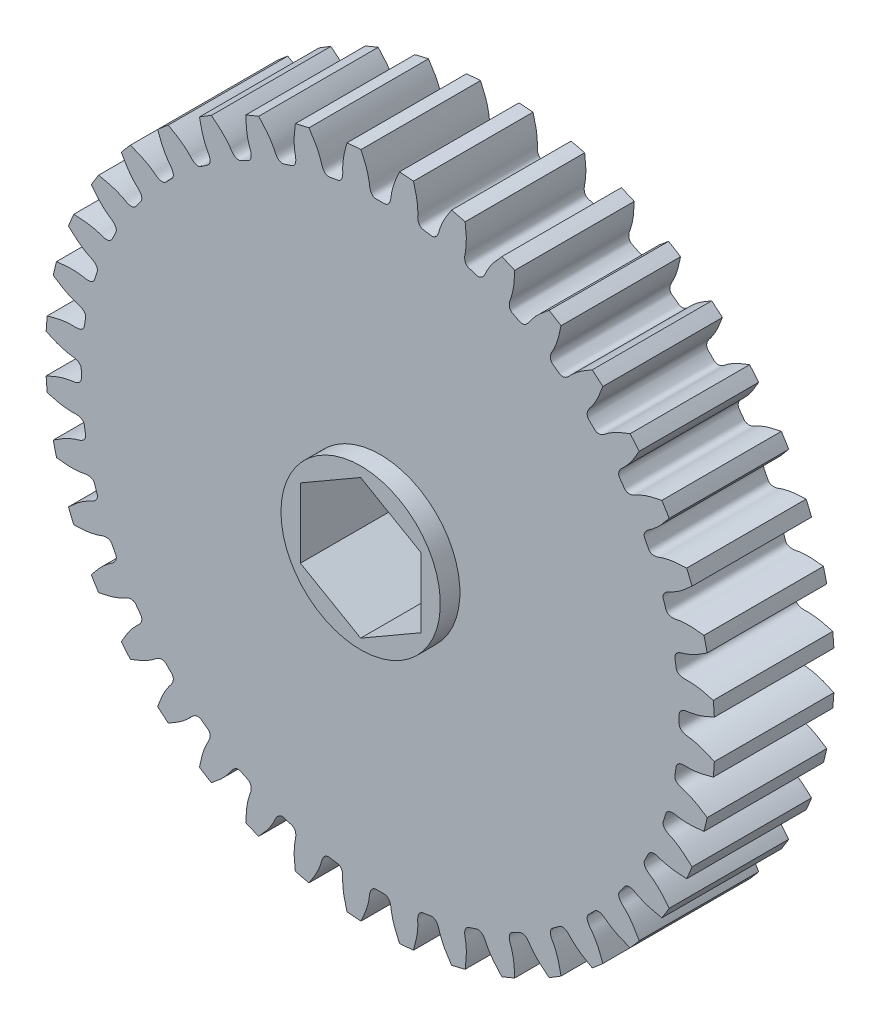
from build123d import *

# Parameters (mm, degrees)
BOSS_EXTRUDE1_DEPTH = 9.525
SKETCH2_R           = 6.35
BOSS_EXTRUDE2_DEPTH = 1.5621
BOSS_EXTRUDE3_START = 1.5621
SKETCH3_R           = 6.35
BOSS_EXTRUDE3_DEPTH = 1.5621
CUT_EXTRUDE1_DEPTH  = 40.722420689
SKETCH7_W           = 2.778125
SKETCH7_H           = 11.90625
FILLET1_R           = 1.5875


with BuildPart() as part:
    # Sketch1 → Boss-Extrude1 (new body)
    with BuildSketch(Plane(origin=(0, 0, -4.7625), x_dir=(-1, 0, 0), z_dir=(0, 0, -1))):
        with BuildLine():
            ThreePointArc((-25.796844139, 6.768436486), (-25.933105777, 6.225987854), (-26.057962294, 5.680801095))
            add(Edge.make_bspline(
                [(-26.538058921, 2.649590288), (-26.346435583, 2.708405668), (-26.095635845, 2.777592561), (-25.787565675, 2.84804005), (-25.623095813, 2.882036671), (-25.468603865, 2.910607439), (-25.324240561, 2.934186764), (-25.190142623, 2.953213264), (-25.06643285, 2.968128812), (-24.953219968, 2.979378698), (-24.850598663, 2.987409714), (-24.758649208, 2.992674564), (-24.677438402, 2.995616326), (-24.607016458, 2.996714746), (-24.54742621, 2.996345626), (-24.481053639, 2.994767032), (-24.422080222, 2.990385038), (-24.36698261, 2.987604644), (-24.330087377, 2.986413555), (-24.294043161, 2.985903027), (-24.25881806, 2.986082526), (-24.22437529, 2.986955025), (-24.1906708, 2.988531322), (-24.157652377, 2.990828084), (-24.125258084, 2.993870672), (-24.093414571, 2.997695491), (-24.062035097, 3.002353509), (-24.031017368, 3.007914921), (-24.000241282, 3.014475479), (-23.969566905, 3.022165081), (-23.938833278, 3.031159397), (-23.90785924, 3.04169547), (-23.87644845, 3.054092242), (-23.844402438, 3.06877652), (-23.81154811, 3.08631336), (-23.77778938, 3.107435856), (-23.743196072, 3.133060919), (-23.708138554, 3.164262644), (-23.673470271, 3.202155715), (-23.640667386, 3.247631948), (-23.611960583, 3.30093819), (-23.590578681, 3.358597809), (-23.561503956, 3.501074849), (-23.536937958, 3.727884745), (-23.490213498, 3.951185086), (-23.473837378, 4.095673388), (-23.476354973, 4.157118315), (-23.48718423, 4.216686454), (-23.504328699, 4.27007357), (-23.525590593, 4.316825112), (-23.549290411, 4.357333084), (-23.574272021, 4.392393888), (-23.599851272, 4.422914596), (-23.625678413, 4.449745667), (-23.65161829, 4.473614008), (-23.677660913, 4.495110506), (-23.703863148, 4.514702412), (-23.730313168, 4.532753728), (-23.757110016, 4.549545878), (-23.784352489, 4.565295672), (-23.812133532, 4.580169895), (-23.840537778, 4.594296724), (-23.869640825, 4.60777453), (-23.899509416, 4.62067859), (-23.930202064, 4.633066195), (-23.961769837, 4.644980602), (-23.994257241, 4.656453799), (-24.027702834, 4.667509668), (-24.062140682, 4.678162403), (-24.097598201, 4.688430863), (-24.150858333, 4.70281265), (-24.208299496, 4.716868914), (-24.271911375, 4.735877835), (-24.328699133, 4.75394118), (-24.39533495, 4.776747417), (-24.471661963, 4.804640718), (-24.557484163, 4.838061832), (-24.652601103, 4.877411509), (-24.756796547, 4.923095491), (-24.869842375, 4.975509442), (-24.991497581, 5.035043262), (-25.121508829, 5.102079246), (-25.25961055, 5.176992299), (-25.405525151, 5.260148989), (-25.676747823, 5.42234745), (-25.893892621, 5.565649477), (-26.057962294, 5.680801095)],
                knots=[0, 0, 0, 0, 0.085621698, 0.111077756, 0.134991023, 0.157361498, 0.178189182, 0.197474075, 0.215216176, 0.231415486, 0.246072005, 0.259185732, 0.270756668, 0.280784812, 0.289270165, 0.296212727, 0.309141565, 0.314524909, 0.319779282, 0.324910023, 0.3299233, 0.334826267, 0.339627264, 0.344336062, 0.34896417, 0.353525211, 0.358035401, 0.362514142, 0.366984759, 0.37147542, 0.376020255, 0.380660689, 0.38544696, 0.390439674, 0.395711073, 0.401345277, 0.407436134, 0.414080402, 0.421363225, 0.429333468, 0.437970745, 0.447155355, 0.455484445, 0.5, 0.544515555, 0.552844645, 0.562029255, 0.570666532, 0.578636775, 0.585919598, 0.592563866, 0.598654723, 0.604288927, 0.609560326, 0.61455304, 0.619339311, 0.623979745, 0.62852458, 0.633015241, 0.637485858, 0.641964599, 0.646474789, 0.65103583, 0.655663938, 0.660372736, 0.665173733, 0.6700767, 0.675089977, 0.680220718, 0.685475091, 0.690858435, 0.703787273, 0.710729835, 0.719215188, 0.729243332, 0.740814268, 0.753927995, 0.768584514, 0.784783824, 0.802525925, 0.821810818, 0.842638502, 0.865008977, 0.888922244, 0.914378302, 1, 1, 1, 1], degree=3))
            ThreePointArc((-26.538058921, 2.649590288), (-26.587785291, 2.092504083), (-26.625818618, 1.534497615))
            add(Edge.make_bspline(
                [(-26.625818618, -1.534497615), (-26.445755233, -1.446429856), (-26.208866471, -1.338861045), (-25.915609572, -1.22108809), (-25.758482849, -1.161781269), (-25.610362406, -1.109394389), (-25.471465074, -1.063521969), (-25.341994504, -1.023752177), (-25.222141109, -0.989667792), (-25.112081935, -0.960846015), (-25.011980397, -0.936860365), (-24.921986596, -0.91727627), (-24.842235822, -0.901666557), (-24.772852721, -0.889565241), (-24.713938384, -0.880607849), (-24.648136023, -0.871784049), (-24.589203172, -0.866886619), (-24.534348953, -0.861013616), (-24.497721634, -0.856418355), (-24.462041319, -0.85128404), (-24.427277977, -0.84559633), (-24.393395743, -0.839346537), (-24.360352799, -0.832517104), (-24.32810018, -0.825083399), (-24.296580681, -0.817010686), (-24.265727547, -0.808251534), (-24.235463081, -0.798742033), (-24.205697228, -0.788396849), (-24.176326345, -0.777102622), (-24.147232539, -0.764709162), (-24.118284315, -0.751017783), (-24.089339823, -0.735766019), (-24.060255035, -0.718608142), (-24.03090069, -0.69909155), (-24.00119422, -0.676631069), (-23.971155401, -0.650487598), (-23.940996638, -0.619766436), (-23.911251761, -0.583464652), (-23.882938084, -0.540614792), (-23.857653107, -0.490566946), (-23.837638666, -0.433426259), (-23.825539963, -0.373131659), (-23.819111516, -0.227860459), (-23.83032885, 0), (-23.819111516, 0.227860459), (-23.825539963, 0.373131659), (-23.837638666, 0.433426259), (-23.857653107, 0.490566946), (-23.882938084, 0.540614792), (-23.911251761, 0.583464652), (-23.940996638, 0.619766436), (-23.971155401, 0.650487598), (-24.00119422, 0.676631069), (-24.03090069, 0.69909155), (-24.060255035, 0.718608142), (-24.089339823, 0.735766019), (-24.118284315, 0.751017783), (-24.147232539, 0.764709162), (-24.176326345, 0.777102622), (-24.205697228, 0.788396849), (-24.235463081, 0.798742033), (-24.265727547, 0.808251534), (-24.296580681, 0.817010686), (-24.32810018, 0.825083399), (-24.360352799, 0.832517104), (-24.393395743, 0.839346537), (-24.427277977, 0.84559633), (-24.462041319, 0.85128404), (-24.497721634, 0.856418355), (-24.534348953, 0.861013616), (-24.589203172, 0.866886619), (-24.648136023, 0.871784049), (-24.713938384, 0.880607849), (-24.772852721, 0.889565241), (-24.842235822, 0.901666557), (-24.921986596, 0.91727627), (-25.011980397, 0.936860365), (-25.112081935, 0.960846015), (-25.222141109, 0.989667792), (-25.341994504, 1.023752177), (-25.471465074, 1.063521969), (-25.610362406, 1.109394389), (-25.758482849, 1.161781269), (-25.915609572, 1.22108809), (-26.208866471, 1.338861045), (-26.445755233, 1.446429856), (-26.625818618, 1.534497615)],
                knots=[0, 0, 0, 0, 0.085621698, 0.111077756, 0.134991023, 0.157361498, 0.178189182, 0.197474075, 0.215216176, 0.231415486, 0.246072005, 0.259185732, 0.270756668, 0.280784812, 0.289270165, 0.296212727, 0.309141565, 0.314524909, 0.319779282, 0.324910023, 0.3299233, 0.334826267, 0.339627264, 0.344336062, 0.34896417, 0.353525211, 0.358035401, 0.362514142, 0.366984759, 0.37147542, 0.376020255, 0.380660689, 0.38544696, 0.390439674, 0.395711073, 0.401345277, 0.407436134, 0.414080402, 0.421363225, 0.429333468, 0.437970745, 0.447155355, 0.455484445, 0.5, 0.544515555, 0.552844645, 0.562029255, 0.570666532, 0.578636775, 0.585919598, 0.592563866, 0.598654723, 0.604288927, 0.609560326, 0.61455304, 0.619339311, 0.623979745, 0.62852458, 0.633015241, 0.637485858, 0.641964599, 0.646474789, 0.65103583, 0.655663938, 0.660372736, 0.665173733, 0.6700767, 0.675089977, 0.680220718, 0.685475091, 0.690858435, 0.703787273, 0.710729835, 0.719215188, 0.729243332, 0.740814268, 0.753927995, 0.768584514, 0.784783824, 0.802525925, 0.821810818, 0.842638502, 0.865008977, 0.888922244, 0.914378302, 1, 1, 1, 1], degree=3))
            ThreePointArc((-26.625818618, -1.534497615), (-26.587785291, -2.092504083), (-26.538058921, -2.649590288))
            add(Edge.make_bspline(
                [(-26.057962294, -5.680801095), (-25.893892621, -5.565649477), (-25.676747823, -5.42234745), (-25.405525151, -5.260148989), (-25.25961055, -5.176992299), (-25.121508829, -5.102079246), (-24.991497581, -5.035043262), (-24.869842375, -4.975509442), (-24.756796547, -4.923095491), (-24.652601103, -4.877411509), (-24.557484163, -4.838061832), (-24.471661963, -4.804640718), (-24.39533495, -4.776747417), (-24.328699133, -4.75394118), (-24.271911375, -4.735877835), (-24.208299496, -4.716868914), (-24.150858333, -4.70281265), (-24.097598201, -4.688430863), (-24.062140682, -4.678162403), (-24.027702834, -4.667509668), (-23.994257241, -4.656453799), (-23.961769837, -4.644980602), (-23.930202064, -4.633066195), (-23.899509416, -4.62067859), (-23.869640825, -4.60777453), (-23.840537778, -4.594296724), (-23.812133532, -4.580169895), (-23.784352489, -4.565295672), (-23.757110016, -4.549545878), (-23.730313168, -4.532753728), (-23.703863148, -4.514702412), (-23.677660913, -4.495110506), (-23.65161829, -4.473614008), (-23.625678413, -4.449745667), (-23.599851272, -4.422914596), (-23.574272021, -4.392393888), (-23.549290411, -4.357333084), (-23.525590593, -4.316825112), (-23.504328699, -4.27007357), (-23.48718423, -4.216686454), (-23.476354973, -4.157118315), (-23.473837378, -4.095673388), (-23.490213498, -3.951185086), (-23.536937958, -3.727884745), (-23.561503956, -3.501074849), (-23.590578681, -3.358597809), (-23.611960583, -3.30093819), (-23.640667386, -3.247631948), (-23.673470271, -3.202155715), (-23.708138554, -3.164262644), (-23.743196072, -3.133060919), (-23.77778938, -3.107435856), (-23.81154811, -3.08631336), (-23.844402438, -3.06877652), (-23.87644845, -3.054092242), (-23.90785924, -3.04169547), (-23.938833278, -3.031159397), (-23.969566905, -3.022165081), (-24.000241282, -3.014475479), (-24.031017368, -3.007914921), (-24.062035097, -3.002353509), (-24.093414571, -2.997695491), (-24.125258084, -2.993870672), (-24.157652377, -2.990828084), (-24.1906708, -2.988531322), (-24.22437529, -2.986955025), (-24.25881806, -2.986082526), (-24.294043161, -2.985903027), (-24.330087377, -2.986413555), (-24.36698261, -2.987604644), (-24.422080222, -2.990385038), (-24.481053639, -2.994767032), (-24.54742621, -2.996345626), (-24.607016458, -2.996714746), (-24.677438402, -2.995616326), (-24.758649208, -2.992674564), (-24.850598663, -2.987409714), (-24.953219968, -2.979378698), (-25.06643285, -2.968128812), (-25.190142623, -2.953213264), (-25.324240561, -2.934186764), (-25.468603865, -2.910607439), (-25.623095813, -2.882036671), (-25.787565675, -2.84804005), (-26.095635845, -2.777592561), (-26.346435583, -2.708405668), (-26.538058921, -2.649590288)],
                knots=[0, 0, 0, 0, 0.085621698, 0.111077756, 0.134991023, 0.157361498, 0.178189182, 0.197474075, 0.215216176, 0.231415486, 0.246072005, 0.259185732, 0.270756668, 0.280784812, 0.289270165, 0.296212727, 0.309141565, 0.314524909, 0.319779282, 0.324910023, 0.3299233, 0.334826267, 0.339627264, 0.344336062, 0.34896417, 0.353525211, 0.358035401, 0.362514142, 0.366984759, 0.37147542, 0.376020255, 0.380660689, 0.38544696, 0.390439674, 0.395711073, 0.401345277, 0.407436134, 0.414080402, 0.421363225, 0.429333468, 0.437970745, 0.447155355, 0.455484445, 0.5, 0.544515555, 0.552844645, 0.562029255, 0.570666532, 0.578636775, 0.585919598, 0.592563866, 0.598654723, 0.604288927, 0.609560326, 0.61455304, 0.619339311, 0.623979745, 0.62852458, 0.633015241, 0.637485858, 0.641964599, 0.646474789, 0.65103583, 0.655663938, 0.660372736, 0.665173733, 0.6700767, 0.675089977, 0.680220718, 0.685475091, 0.690858435, 0.703787273, 0.710729835, 0.719215188, 0.729243332, 0.740814268, 0.753927995, 0.768584514, 0.784783824, 0.802525925, 0.821810818, 0.842638502, 0.865008977, 0.888922244, 0.914378302, 1, 1, 1, 1], degree=3))
            ThreePointArc((-26.057962294, -5.680801095), (-25.933105777, -6.225987854), (-25.796844139, -6.768436486))
            add(Edge.make_bspline(
                [(-24.848472457, -9.687224398), (-24.704436436, -9.547824336), (-24.512382426, -9.372317665), (-24.269872385, -9.169687562), (-24.138762808, -9.064728596), (-24.014080331, -8.969133978), (-23.896156475, -8.882585078), (-23.785312188, -8.804753152), (-23.681857491, -8.73530024), (-23.586091415, -8.673878946), (-23.498301168, -8.620134161), (-23.418763795, -8.573698966), (-23.347739969, -8.534208902), (-23.28549223, -8.501259309), (-23.232229353, -8.474534791), (-23.172374293, -8.445808812), (-23.117839209, -8.422939826), (-23.067484605, -8.400403382), (-23.034069969, -8.384714566), (-23.001722563, -8.368805718), (-22.970418259, -8.352653921), (-22.940125632, -8.336239828), (-22.910810335, -8.31953382), (-22.882433413, -8.30249734), (-22.854951194, -8.285079672), (-22.828314846, -8.267215081), (-22.802470227, -8.248818774), (-22.777358056, -8.229781765), (-22.752914794, -8.209964215), (-22.72907473, -8.189186854), (-22.705774202, -8.167220084), (-22.682959409, -8.143770455), (-22.660600207, -8.118464651), (-22.638713524, -8.090832278), (-22.617401662, -8.060291287), (-22.596911825, -8.026144862), (-22.577722498, -7.987607731), (-22.560651307, -7.94389101), (-22.546964735, -7.894388965), (-22.538382928, -7.838977147), (-22.537005507, -7.778448322), (-22.544131012, -7.717366045), (-22.582908465, -7.577218424), (-22.663989538, -7.363976596), (-22.723733974, -7.143802075), (-22.77473906, -7.007627453), (-22.804877667, -6.954022585), (-22.841569974, -6.905863366), (-22.881083051, -6.866078522), (-22.921252294, -6.834075292), (-22.96075922, -6.808741916), (-22.99893527, -6.788843925), (-23.035582661, -6.773262512), (-23.070775863, -6.761081129), (-23.104724463, -6.751590739), (-23.137687816, -6.744260322), (-23.169928717, -6.738699372), (-23.201690984, -6.73462359), (-23.233190627, -6.73182719), (-23.264614105, -6.730161844), (-23.296119951, -6.729521144), (-23.327841766, -6.729829304), (-23.359891567, -6.731032999), (-23.392362997, -6.733095453), (-23.425334201, -6.735992187), (-23.45887032, -6.739707842), (-23.493025532, -6.744234121), (-23.527845034, -6.749567251), (-23.563365621, -6.755710051), (-23.599620285, -6.762658163), (-23.653604604, -6.77402349), (-23.711166466, -6.78757701), (-23.776474934, -6.799519126), (-23.835273785, -6.80920567), (-23.905000548, -6.819137193), (-23.985671707, -6.828935818), (-24.077312716, -6.838119851), (-24.17992691, -6.846241219), (-24.293505824, -6.852840235), (-24.41802583, -6.857460794), (-24.5534492, -6.85964608), (-24.699723771, -6.858940453), (-24.85678312, -6.854889303), (-25.024546328, -6.847039992), (-25.339844058, -6.825652621), (-25.59837925, -6.796551256), (-25.796844139, -6.768436486)],
                knots=[0, 0, 0, 0, 0.085621698, 0.111077756, 0.134991023, 0.157361498, 0.178189182, 0.197474075, 0.215216176, 0.231415486, 0.246072005, 0.259185732, 0.270756668, 0.280784812, 0.289270165, 0.296212727, 0.309141565, 0.314524909, 0.319779282, 0.324910023, 0.3299233, 0.334826267, 0.339627264, 0.344336062, 0.34896417, 0.353525211, 0.358035401, 0.362514142, 0.366984759, 0.37147542, 0.376020255, 0.380660689, 0.38544696, 0.390439674, 0.395711073, 0.401345277, 0.407436134, 0.414080402, 0.421363225, 0.429333468, 0.437970745, 0.447155355, 0.455484445, 0.5, 0.544515555, 0.552844645, 0.562029255, 0.570666532, 0.578636775, 0.585919598, 0.592563866, 0.598654723, 0.604288927, 0.609560326, 0.61455304, 0.619339311, 0.623979745, 0.62852458, 0.633015241, 0.637485858, 0.641964599, 0.646474789, 0.65103583, 0.655663938, 0.660372736, 0.665173733, 0.6700767, 0.675089977, 0.680220718, 0.685475091, 0.690858435, 0.703787273, 0.710729835, 0.719215188, 0.729243332, 0.740814268, 0.753927995, 0.768584514, 0.784783824, 0.802525925, 0.821810818, 0.842638502, 0.865008977, 0.888922244, 0.914378302, 1, 1, 1, 1], degree=3))
            ThreePointArc((-24.848472457, -9.687224398), (-24.639867132, -10.206167141), (-24.42042544, -10.720621314))
            add(Edge.make_bspline(
                [(-23.027130761, -13.455116087), (-22.906675037, -13.294900073), (-22.744440822, -13.091510313), (-22.536614814, -12.853437995), (-22.423538613, -12.729261192), (-22.315345477, -12.615338866), (-22.212412691, -12.511408171), (-22.115108677, -12.417194618), (-22.023792507, -12.332412906), (-21.938813878, -12.256766695), (-21.860512011, -12.189950177), (-21.789217941, -12.13164429), (-21.725246142, -12.081529841), (-21.668919229, -12.039248221), (-21.620492742, -12.004520576), (-21.565868329, -11.966784866), (-21.515582161, -11.935666269), (-21.469372982, -11.905530091), (-21.438824007, -11.884807229), (-21.409363543, -11.864033997), (-21.380971345, -11.843183983), (-21.353619401, -11.822233164), (-21.327278419, -11.801146912), (-21.301915957, -11.77988105), (-21.277496812, -11.758378657), (-21.253983041, -11.736567166), (-21.231334428, -11.714354358), (-21.209509474, -11.691623317), (-21.188467296, -11.668225985), (-21.168171039, -11.643975021), (-21.148593738, -11.618633693), (-21.129728164, -11.591903748), (-21.111602941, -11.56341175), (-21.094308374, -11.532695746), (-21.078036561, -11.499196855), (-21.063140665, -11.462265514), (-21.050216126, -11.421200966), (-21.040193912, -11.375351948), (-21.03441967, -11.324318303), (-21.034611838, -11.268246206), (-21.042720169, -11.208247116), (-21.059313321, -11.149031537), (-21.119537277, -11.016675496), (-21.232978479, -10.818742904), (-21.326430245, -10.610625185), (-21.398109778, -10.484106052), (-21.436262977, -10.435875866), (-21.480037303, -10.394049508), (-21.525287629, -10.360935689), (-21.56996873, -10.335610325), (-21.612952274, -10.31676909), (-21.653771045, -10.303088127), (-21.692404715, -10.293431461), (-21.729070219, -10.286905481), (-21.764085479, -10.282842665), (-21.797789729, -10.280759102), (-21.830503615, -10.280310205), (-21.862512428, -10.281253315), (-21.894061712, -10.283418973), (-21.925358833, -10.286689845), (-21.956577017, -10.290985633), (-21.987860077, -10.296252385), (-22.019326992, -10.302454954), (-22.051076006, -10.309571667), (-22.083188131, -10.31759057), (-22.115730108, -10.326506683), (-22.148756746, -10.336320289), (-22.182313277, -10.347034729), (-22.216435601, -10.358658545), (-22.251156986, -10.371192593), (-22.30269874, -10.390863003), (-22.357431682, -10.413254315), (-22.420067936, -10.435265899), (-22.476627566, -10.454031353), (-22.543942244, -10.474748271), (-22.622087365, -10.497046008), (-22.711163422, -10.520452782), (-22.811243803, -10.544526559), (-22.922392058, -10.568811987), (-23.044656202, -10.59285488), (-23.178070432, -10.616198145), (-23.322654504, -10.638383589), (-23.478413931, -10.658951811), (-23.645339599, -10.677443085), (-23.960101213, -10.70564246), (-24.220005863, -10.717343196), (-24.42042544, -10.720621314)],
                knots=[0, 0, 0, 0, 0.085621698, 0.111077756, 0.134991023, 0.157361498, 0.178189182, 0.197474075, 0.215216176, 0.231415486, 0.246072005, 0.259185732, 0.270756668, 0.280784812, 0.289270165, 0.296212727, 0.309141565, 0.314524909, 0.319779282, 0.324910023, 0.3299233, 0.334826267, 0.339627264, 0.344336062, 0.34896417, 0.353525211, 0.358035401, 0.362514142, 0.366984759, 0.37147542, 0.376020255, 0.380660689, 0.38544696, 0.390439674, 0.395711073, 0.401345277, 0.407436134, 0.414080402, 0.421363225, 0.429333468, 0.437970745, 0.447155355, 0.455484445, 0.5, 0.544515555, 0.552844645, 0.562029255, 0.570666532, 0.578636775, 0.585919598, 0.592563866, 0.598654723, 0.604288927, 0.609560326, 0.61455304, 0.619339311, 0.623979745, 0.62852458, 0.633015241, 0.637485858, 0.641964599, 0.646474789, 0.65103583, 0.655663938, 0.660372736, 0.665173733, 0.6700767, 0.675089977, 0.680220718, 0.685475091, 0.690858435, 0.703787273, 0.710729835, 0.719215188, 0.729243332, 0.740814268, 0.753927995, 0.768584514, 0.784783824, 0.802525925, 0.821810818, 0.842638502, 0.865008977, 0.888922244, 0.914378302, 1, 1, 1, 1], degree=3))
            ThreePointArc((-23.027130761, -13.455116087), (-22.739913183, -13.935036721), (-22.442694819, -14.408828865))
            add(Edge.make_bspline(
                [(-20.638784683, -16.891698162), (-20.544875275, -16.714611246), (-20.416455601, -16.48834653), (-20.248430992, -16.220694127), (-20.156172478, -16.080357131), (-20.067132758, -15.950912242), (-19.981725587, -15.832158872), (-19.900357794, -15.723883542), (-19.823428659, -15.625860638), (-19.751329932, -15.537852171), (-19.684444498, -15.459609165), (-19.623149226, -15.39086827), (-19.567804654, -15.331363418), (-19.518785521, -15.280790885), (-19.476387845, -15.238915223), (-19.428339115, -15.193098962), (-19.383540074, -15.154496997), (-19.342614144, -15.117503137), (-19.315683047, -15.092256495), (-19.28983494, -15.067130384), (-19.265053957, -15.04209555), (-19.241316191, -15.017123884), (-19.218598127, -14.992176601), (-19.196874633, -14.967204994), (-19.176119844, -14.942147335), (-19.156307634, -14.916926015), (-19.137412712, -14.89144366), (-19.119412378, -14.865578302), (-19.102289414, -14.839177308), (-19.086036723, -14.812049878), (-19.070664709, -14.78395798), (-19.056212886, -14.754605899), (-19.042767945, -14.723629275), (-19.030491345, -14.69058597), (-19.019660245, -14.654954034), (-19.010725078, -14.616147147), (-19.004383572, -14.573566328), (-19.001657114, -14.526713968), (-19.003937383, -14.475405342), (-19.012898794, -14.420053647), (-19.030293224, -14.362061667), (-19.055945444, -14.306170871), (-19.13613299, -14.184865455), (-19.279141021, -14.007115855), (-19.403999025, -13.816179488), (-19.494588016, -13.702431165), (-19.53981635, -13.660763248), (-19.589594826, -13.626299655), (-19.639468188, -13.600672233), (-19.687560949, -13.58264833), (-19.732962713, -13.57076317), (-19.775419111, -13.563636104), (-19.815087773, -13.560141966), (-19.852322751, -13.55943208), (-19.88754248, -13.560896877), (-19.921157715, -13.564111473), (-19.953539063, -13.568785682), (-19.985006259, -13.574724462), (-20.015828335, -13.581798852), (-20.046228459, -13.589925403), (-20.076390287, -13.599051903), (-20.106464298, -13.609147561), (-20.136573508, -13.620196276), (-20.16681834, -13.63219201), (-20.197280679, -13.645135631), (-20.228027223, -13.659032659), (-20.259112062, -13.673891947), (-20.290579348, -13.689723873), (-20.322463205, -13.706542488), (-20.354796354, -13.724353842), (-20.402626414, -13.751844983), (-20.45318273, -13.782522739), (-20.511604457, -13.814061794), (-20.56453218, -13.841444089), (-20.627777263, -13.872436282), (-20.701472154, -13.906684088), (-20.78578991, -13.943737251), (-20.880872167, -13.983170661), (-20.986852925, -14.024544513), (-21.103850657, -14.067417724), (-21.231970645, -14.111344178), (-21.371304079, -14.155874414), (-21.521928271, -14.20055555), (-21.683906134, -14.244932094), (-21.990381156, -14.322023852), (-22.245255551, -14.374238577), (-22.442694819, -14.408828865)],
                knots=[0, 0, 0, 0, 0.085621698, 0.111077756, 0.134991023, 0.157361498, 0.178189182, 0.197474075, 0.215216176, 0.231415486, 0.246072005, 0.259185732, 0.270756668, 0.280784812, 0.289270165, 0.296212727, 0.309141565, 0.314524909, 0.319779282, 0.324910023, 0.3299233, 0.334826267, 0.339627264, 0.344336062, 0.34896417, 0.353525211, 0.358035401, 0.362514142, 0.366984759, 0.37147542, 0.376020255, 0.380660689, 0.38544696, 0.390439674, 0.395711073, 0.401345277, 0.407436134, 0.414080402, 0.421363225, 0.429333468, 0.437970745, 0.447155355, 0.455484445, 0.5, 0.544515555, 0.552844645, 0.562029255, 0.570666532, 0.578636775, 0.585919598, 0.592563866, 0.598654723, 0.604288927, 0.609560326, 0.61455304, 0.619339311, 0.623979745, 0.62852458, 0.633015241, 0.637485858, 0.641964599, 0.646474789, 0.65103583, 0.655663938, 0.660372736, 0.665173733, 0.6700767, 0.675089977, 0.680220718, 0.685475091, 0.690858435, 0.703787273, 0.710729835, 0.719215188, 0.729243332, 0.740814268, 0.753927995, 0.768584514, 0.784783824, 0.802525925, 0.821810818, 0.842638502, 0.865008977, 0.888922244, 0.914378302, 1, 1, 1, 1], degree=3))
            ThreePointArc((-20.638784683, -16.891698162), (-20.280027103, -17.320779449), (-19.912350569, -17.74224323))
            add(Edge.make_bspline(
                [(-17.74224323, -19.912350569), (-17.677192499, -19.722753219), (-17.585749485, -19.479184933), (-17.461663598, -19.188542936), (-17.392494482, -19.03550131), (-17.32480063, -18.893721221), (-17.259022084, -18.763069277), (-17.195594056, -18.643398269), (-17.134946208, -18.534547822), (-17.077502693, -18.436344159), (-17.023680633, -18.348601267), (-16.973893452, -18.271117993), (-16.928538873, -18.203687947), (-16.888034534, -18.146069763), (-16.85270964, -18.098077203), (-16.812419712, -18.045308539), (-16.7742109, -18.000173713), (-16.73957595, -17.957233083), (-16.716925865, -17.928084318), (-16.695326581, -17.899224016), (-16.674767004, -17.870620803), (-16.655227918, -17.842243174), (-16.636692167, -17.814049145), (-16.619142544, -17.785986677), (-16.602563163, -17.757990755), (-16.586940358, -17.72998064), (-16.572264382, -17.701856198), (-16.558531895, -17.673493412), (-16.545749769, -17.644738836), (-16.533940841, -17.61540291), (-16.523152623, -17.585252157), (-16.513470402, -17.554000685), (-16.505036802, -17.521302182), (-16.49808046, -17.486745212), (-16.492956772, -17.449857607), (-16.490202346, -17.410130729), (-16.490600022, -17.367082121), (-16.495236455, -17.320380079), (-16.505515088, -17.27005986), (-16.523025081, -17.216791509), (-16.549277301, -17.162234596), (-16.583356947, -17.1110448), (-16.681533599, -17.00377695), (-16.850587128, -16.850587128), (-17.00377695, -16.681533599), (-17.1110448, -16.583356947), (-17.162234596, -16.549277301), (-17.216791509, -16.523025081), (-17.27005986, -16.505515088), (-17.320380079, -16.495236455), (-17.367082121, -16.490600022), (-17.410130729, -16.490202346), (-17.449857607, -16.492956772), (-17.486745212, -16.49808046), (-17.521302182, -16.505036802), (-17.554000685, -16.513470402), (-17.585252157, -16.523152623), (-17.61540291, -16.533940841), (-17.644738836, -16.545749769), (-17.673493412, -16.558531895), (-17.701856198, -16.572264382), (-17.72998064, -16.586940358), (-17.757990755, -16.602563163), (-17.785986677, -16.619142544), (-17.814049145, -16.636692167), (-17.842243174, -16.655227918), (-17.870620803, -16.674767004), (-17.899224016, -16.695326581), (-17.928084318, -16.716925865), (-17.957233083, -16.73957595), (-18.000173713, -16.7742109), (-18.045308539, -16.812419712), (-18.098077203, -16.85270964), (-18.146069763, -16.888034534), (-18.203687947, -16.928538873), (-18.271117993, -16.973893452), (-18.348601267, -17.023680633), (-18.436344159, -17.077502693), (-18.534547822, -17.134946208), (-18.643398269, -17.195594056), (-18.763069277, -17.259022084), (-18.893721221, -17.32480063), (-19.03550131, -17.392494482), (-19.188542936, -17.461663598), (-19.479184933, -17.585749485), (-19.722753219, -17.677192499), (-19.912350569, -17.74224323)],
                knots=[0, 0, 0, 0, 0.085621698, 0.111077756, 0.134991023, 0.157361498, 0.178189182, 0.197474075, 0.215216176, 0.231415486, 0.246072005, 0.259185732, 0.270756668, 0.280784812, 0.289270165, 0.296212727, 0.309141565, 0.314524909, 0.319779282, 0.324910023, 0.3299233, 0.334826267, 0.339627264, 0.344336062, 0.34896417, 0.353525211, 0.358035401, 0.362514142, 0.366984759, 0.37147542, 0.376020255, 0.380660689, 0.38544696, 0.390439674, 0.395711073, 0.401345277, 0.407436134, 0.414080402, 0.421363225, 0.429333468, 0.437970745, 0.447155355, 0.455484445, 0.5, 0.544515555, 0.552844645, 0.562029255, 0.570666532, 0.578636775, 0.585919598, 0.592563866, 0.598654723, 0.604288927, 0.609560326, 0.61455304, 0.619339311, 0.623979745, 0.62852458, 0.633015241, 0.637485858, 0.641964599, 0.646474789, 0.65103583, 0.655663938, 0.660372736, 0.665173733, 0.6700767, 0.675089977, 0.680220718, 0.685475091, 0.690858435, 0.703787273, 0.710729835, 0.719215188, 0.729243332, 0.740814268, 0.753927995, 0.768584514, 0.784783824, 0.802525925, 0.821810818, 0.842638502, 0.865008977, 0.888922244, 0.914378302, 1, 1, 1, 1], degree=3))
            ThreePointArc((-17.74224323, -19.912350569), (-17.320779449, -20.280027103), (-16.891698162, -20.638784683))
            add(Edge.make_bspline(
                [(-14.408828865, -22.442694819), (-14.374238577, -22.245255551), (-14.322023852, -21.990381156), (-14.244932094, -21.683906134), (-14.20055555, -21.521928271), (-14.155874414, -21.371304079), (-14.111344178, -21.231970645), (-14.067417724, -21.103850657), (-14.024544513, -20.986852925), (-13.983170661, -20.880872167), (-13.943737251, -20.78578991), (-13.906684088, -20.701472154), (-13.872436282, -20.627777263), (-13.841444089, -20.56453218), (-13.814061794, -20.511604457), (-13.782522739, -20.45318273), (-13.751844983, -20.402626414), (-13.724353842, -20.354796354), (-13.706542488, -20.322463205), (-13.689723873, -20.290579348), (-13.673891947, -20.259112062), (-13.659032659, -20.228027223), (-13.645135631, -20.197280679), (-13.63219201, -20.16681834), (-13.620196276, -20.136573508), (-13.609147561, -20.106464298), (-13.599051903, -20.076390287), (-13.589925403, -20.046228459), (-13.581798852, -20.015828335), (-13.574724462, -19.985006259), (-13.568785682, -19.953539063), (-13.564111473, -19.921157715), (-13.560896877, -19.88754248), (-13.55943208, -19.852322751), (-13.560141966, -19.815087773), (-13.563636104, -19.775419111), (-13.57076317, -19.732962713), (-13.58264833, -19.687560949), (-13.600672233, -19.639468188), (-13.626299655, -19.589594826), (-13.660763248, -19.53981635), (-13.702431165, -19.494588016), (-13.816179488, -19.403999025), (-14.007115855, -19.279141021), (-14.184865455, -19.13613299), (-14.306170871, -19.055945444), (-14.362061667, -19.030293224), (-14.420053647, -19.012898794), (-14.475405342, -19.003937383), (-14.526713968, -19.001657114), (-14.573566328, -19.004383572), (-14.616147147, -19.010725078), (-14.654954034, -19.019660245), (-14.69058597, -19.030491345), (-14.723629275, -19.042767945), (-14.754605899, -19.056212886), (-14.78395798, -19.070664709), (-14.812049878, -19.086036723), (-14.839177308, -19.102289414), (-14.865578302, -19.119412378), (-14.89144366, -19.137412712), (-14.916926015, -19.156307634), (-14.942147335, -19.176119844), (-14.967204994, -19.196874633), (-14.992176601, -19.218598127), (-15.017123884, -19.241316191), (-15.04209555, -19.265053957), (-15.067130384, -19.28983494), (-15.092256495, -19.315683047), (-15.117503137, -19.342614144), (-15.154496997, -19.383540074), (-15.193098962, -19.428339115), (-15.238915223, -19.476387845), (-15.280790885, -19.518785521), (-15.331363418, -19.567804654), (-15.39086827, -19.623149226), (-15.459609165, -19.684444498), (-15.537852171, -19.751329932), (-15.625860638, -19.823428659), (-15.723883542, -19.900357794), (-15.832158872, -19.981725587), (-15.950912242, -20.067132758), (-16.080357131, -20.156172478), (-16.220694127, -20.248430992), (-16.48834653, -20.416455601), (-16.714611246, -20.544875275), (-16.891698162, -20.638784683)],
                knots=[0, 0, 0, 0, 0.085621698, 0.111077756, 0.134991023, 0.157361498, 0.178189182, 0.197474075, 0.215216176, 0.231415486, 0.246072005, 0.259185732, 0.270756668, 0.280784812, 0.289270165, 0.296212727, 0.309141565, 0.314524909, 0.319779282, 0.324910023, 0.3299233, 0.334826267, 0.339627264, 0.344336062, 0.34896417, 0.353525211, 0.358035401, 0.362514142, 0.366984759, 0.37147542, 0.376020255, 0.380660689, 0.38544696, 0.390439674, 0.395711073, 0.401345277, 0.407436134, 0.414080402, 0.421363225, 0.429333468, 0.437970745, 0.447155355, 0.455484445, 0.5, 0.544515555, 0.552844645, 0.562029255, 0.570666532, 0.578636775, 0.585919598, 0.592563866, 0.598654723, 0.604288927, 0.609560326, 0.61455304, 0.619339311, 0.623979745, 0.62852458, 0.633015241, 0.637485858, 0.641964599, 0.646474789, 0.65103583, 0.655663938, 0.660372736, 0.665173733, 0.6700767, 0.675089977, 0.680220718, 0.685475091, 0.690858435, 0.703787273, 0.710729835, 0.719215188, 0.729243332, 0.740814268, 0.753927995, 0.768584514, 0.784783824, 0.802525925, 0.821810818, 0.842638502, 0.865008977, 0.888922244, 0.914378302, 1, 1, 1, 1], degree=3))
            ThreePointArc((-14.408828865, -22.442694819), (-13.935036721, -22.739913183), (-13.455116087, -23.027130761))
            add(Edge.make_bspline(
                [(-10.720621314, -24.42042544), (-10.717343196, -24.220005863), (-10.70564246, -23.960101213), (-10.677443085, -23.645339599), (-10.658951811, -23.478413931), (-10.638383589, -23.322654504), (-10.616198145, -23.178070432), (-10.59285488, -23.044656202), (-10.568811987, -22.922392058), (-10.544526559, -22.811243803), (-10.520452782, -22.711163422), (-10.497046008, -22.622087365), (-10.474748271, -22.543942244), (-10.454031353, -22.476627566), (-10.435265899, -22.420067936), (-10.413254315, -22.357431682), (-10.390863003, -22.30269874), (-10.371192593, -22.251156986), (-10.358658545, -22.216435601), (-10.347034729, -22.182313277), (-10.336320289, -22.148756746), (-10.326506683, -22.115730108), (-10.31759057, -22.083188131), (-10.309571667, -22.051076006), (-10.302454954, -22.019326992), (-10.296252385, -21.987860077), (-10.290985633, -21.956577017), (-10.286689845, -21.925358833), (-10.283418973, -21.894061712), (-10.281253315, -21.862512428), (-10.280310205, -21.830503615), (-10.280759102, -21.797789729), (-10.282842665, -21.764085479), (-10.286905481, -21.729070219), (-10.293431461, -21.692404715), (-10.303088127, -21.653771045), (-10.31676909, -21.612952274), (-10.335610325, -21.56996873), (-10.360935689, -21.525287629), (-10.394049508, -21.480037303), (-10.435875866, -21.436262977), (-10.484106052, -21.398109778), (-10.610625185, -21.326430245), (-10.818742904, -21.232978479), (-11.016675496, -21.119537277), (-11.149031537, -21.059313321), (-11.208247116, -21.042720169), (-11.268246206, -21.034611838), (-11.324318303, -21.03441967), (-11.375351948, -21.040193912), (-11.421200966, -21.050216126), (-11.462265514, -21.063140665), (-11.499196855, -21.078036561), (-11.532695746, -21.094308374), (-11.56341175, -21.111602941), (-11.591903748, -21.129728164), (-11.618633693, -21.148593738), (-11.643975021, -21.168171039), (-11.668225985, -21.188467296), (-11.691623317, -21.209509474), (-11.714354358, -21.231334428), (-11.736567166, -21.253983041), (-11.758378657, -21.277496812), (-11.77988105, -21.301915957), (-11.801146912, -21.327278419), (-11.822233164, -21.353619401), (-11.843183983, -21.380971345), (-11.864033997, -21.409363543), (-11.884807229, -21.438824007), (-11.905530091, -21.469372982), (-11.935666269, -21.515582161), (-11.966784866, -21.565868329), (-12.004520576, -21.620492742), (-12.039248221, -21.668919229), (-12.081529841, -21.725246142), (-12.13164429, -21.789217941), (-12.189950177, -21.860512011), (-12.256766695, -21.938813878), (-12.332412906, -22.023792507), (-12.417194618, -22.115108677), (-12.511408171, -22.212412691), (-12.615338866, -22.315345477), (-12.729261192, -22.423538613), (-12.853437995, -22.536614814), (-13.091510313, -22.744440822), (-13.294900073, -22.906675037), (-13.455116087, -23.027130761)],
                knots=[0, 0, 0, 0, 0.085621698, 0.111077756, 0.134991023, 0.157361498, 0.178189182, 0.197474075, 0.215216176, 0.231415486, 0.246072005, 0.259185732, 0.270756668, 0.280784812, 0.289270165, 0.296212727, 0.309141565, 0.314524909, 0.319779282, 0.324910023, 0.3299233, 0.334826267, 0.339627264, 0.344336062, 0.34896417, 0.353525211, 0.358035401, 0.362514142, 0.366984759, 0.37147542, 0.376020255, 0.380660689, 0.38544696, 0.390439674, 0.395711073, 0.401345277, 0.407436134, 0.414080402, 0.421363225, 0.429333468, 0.437970745, 0.447155355, 0.455484445, 0.5, 0.544515555, 0.552844645, 0.562029255, 0.570666532, 0.578636775, 0.585919598, 0.592563866, 0.598654723, 0.604288927, 0.609560326, 0.61455304, 0.619339311, 0.623979745, 0.62852458, 0.633015241, 0.637485858, 0.641964599, 0.646474789, 0.65103583, 0.655663938, 0.660372736, 0.665173733, 0.6700767, 0.675089977, 0.680220718, 0.685475091, 0.690858435, 0.703787273, 0.710729835, 0.719215188, 0.729243332, 0.740814268, 0.753927995, 0.768584514, 0.784783824, 0.802525925, 0.821810818, 0.842638502, 0.865008977, 0.888922244, 0.914378302, 1, 1, 1, 1], degree=3))
            ThreePointArc((-10.720621314, -24.42042544), (-10.206167141, -24.639867132), (-9.687224398, -24.848472457))
            add(Edge.make_bspline(
                [(-6.768436486, -25.796844139), (-6.796551256, -25.59837925), (-6.825652621, -25.339844058), (-6.847039992, -25.024546328), (-6.854889303, -24.85678312), (-6.858940453, -24.699723771), (-6.85964608, -24.5534492), (-6.857460794, -24.41802583), (-6.852840235, -24.293505824), (-6.846241219, -24.17992691), (-6.838119851, -24.077312716), (-6.828935818, -23.985671707), (-6.819137193, -23.905000548), (-6.80920567, -23.835273785), (-6.799519126, -23.776474934), (-6.78757701, -23.711166466), (-6.77402349, -23.653604604), (-6.762658163, -23.599620285), (-6.755710051, -23.563365621), (-6.749567251, -23.527845034), (-6.744234121, -23.493025532), (-6.739707842, -23.45887032), (-6.735992187, -23.425334201), (-6.733095453, -23.392362997), (-6.731032999, -23.359891567), (-6.729829304, -23.327841766), (-6.729521144, -23.296119951), (-6.730161844, -23.264614105), (-6.73182719, -23.233190627), (-6.73462359, -23.201690984), (-6.738699372, -23.169928717), (-6.744260322, -23.137687816), (-6.751590739, -23.104724463), (-6.761081129, -23.070775863), (-6.773262512, -23.035582661), (-6.788843925, -22.99893527), (-6.808741916, -22.96075922), (-6.834075292, -22.921252294), (-6.866078522, -22.881083051), (-6.905863366, -22.841569974), (-6.954022585, -22.804877667), (-7.007627453, -22.77473906), (-7.143802075, -22.723733974), (-7.363976596, -22.663989538), (-7.577218424, -22.582908465), (-7.717366045, -22.544131012), (-7.778448322, -22.537005507), (-7.838977147, -22.538382928), (-7.894388965, -22.546964735), (-7.94389101, -22.560651307), (-7.987607731, -22.577722498), (-8.026144862, -22.596911825), (-8.060291287, -22.617401662), (-8.090832278, -22.638713524), (-8.118464651, -22.660600207), (-8.143770455, -22.682959409), (-8.167220084, -22.705774202), (-8.189186854, -22.72907473), (-8.209964215, -22.752914794), (-8.229781765, -22.777358056), (-8.248818774, -22.802470227), (-8.267215081, -22.828314846), (-8.285079672, -22.854951194), (-8.30249734, -22.882433413), (-8.31953382, -22.910810335), (-8.336239828, -22.940125632), (-8.352653921, -22.970418259), (-8.368805718, -23.001722563), (-8.384714566, -23.034069969), (-8.400403382, -23.067484605), (-8.422939826, -23.117839209), (-8.445808812, -23.172374293), (-8.474534791, -23.232229353), (-8.501259309, -23.28549223), (-8.534208902, -23.347739969), (-8.573698966, -23.418763795), (-8.620134161, -23.498301168), (-8.673878946, -23.586091415), (-8.73530024, -23.681857491), (-8.804753152, -23.785312188), (-8.882585078, -23.896156475), (-8.969133978, -24.014080331), (-9.064728596, -24.138762808), (-9.169687562, -24.269872385), (-9.372317665, -24.512382426), (-9.547824336, -24.704436436), (-9.687224398, -24.848472457)],
                knots=[0, 0, 0, 0, 0.085621698, 0.111077756, 0.134991023, 0.157361498, 0.178189182, 0.197474075, 0.215216176, 0.231415486, 0.246072005, 0.259185732, 0.270756668, 0.280784812, 0.289270165, 0.296212727, 0.309141565, 0.314524909, 0.319779282, 0.324910023, 0.3299233, 0.334826267, 0.339627264, 0.344336062, 0.34896417, 0.353525211, 0.358035401, 0.362514142, 0.366984759, 0.37147542, 0.376020255, 0.380660689, 0.38544696, 0.390439674, 0.395711073, 0.401345277, 0.407436134, 0.414080402, 0.421363225, 0.429333468, 0.437970745, 0.447155355, 0.455484445, 0.5, 0.544515555, 0.552844645, 0.562029255, 0.570666532, 0.578636775, 0.585919598, 0.592563866, 0.598654723, 0.604288927, 0.609560326, 0.61455304, 0.619339311, 0.623979745, 0.62852458, 0.633015241, 0.637485858, 0.641964599, 0.646474789, 0.65103583, 0.655663938, 0.660372736, 0.665173733, 0.6700767, 0.675089977, 0.680220718, 0.685475091, 0.690858435, 0.703787273, 0.710729835, 0.719215188, 0.729243332, 0.740814268, 0.753927995, 0.768584514, 0.784783824, 0.802525925, 0.821810818, 0.842638502, 0.865008977, 0.888922244, 0.914378302, 1, 1, 1, 1], degree=3))
            ThreePointArc((-6.768436486, -25.796844139), (-6.225987854, -25.933105777), (-5.680801095, -26.057962294))
            add(Edge.make_bspline(
                [(-2.649590288, -26.538058921), (-2.708405668, -26.346435583), (-2.777592561, -26.095635845), (-2.84804005, -25.787565675), (-2.882036671, -25.623095813), (-2.910607439, -25.468603865), (-2.934186764, -25.324240561), (-2.953213264, -25.190142623), (-2.968128812, -25.06643285), (-2.979378698, -24.953219968), (-2.987409714, -24.850598663), (-2.992674564, -24.758649208), (-2.995616326, -24.677438402), (-2.996714746, -24.607016458), (-2.996345626, -24.54742621), (-2.994767032, -24.481053639), (-2.990385038, -24.422080222), (-2.987604644, -24.36698261), (-2.986413555, -24.330087377), (-2.985903027, -24.294043161), (-2.986082526, -24.25881806), (-2.986955025, -24.22437529), (-2.988531322, -24.1906708), (-2.990828084, -24.157652377), (-2.993870672, -24.125258084), (-2.997695491, -24.093414571), (-3.002353509, -24.062035097), (-3.007914921, -24.031017368), (-3.014475479, -24.000241282), (-3.022165081, -23.969566905), (-3.031159397, -23.938833278), (-3.04169547, -23.90785924), (-3.054092242, -23.87644845), (-3.06877652, -23.844402438), (-3.08631336, -23.81154811), (-3.107435856, -23.77778938), (-3.133060919, -23.743196072), (-3.164262644, -23.708138554), (-3.202155715, -23.673470271), (-3.247631948, -23.640667386), (-3.30093819, -23.611960583), (-3.358597809, -23.590578681), (-3.501074849, -23.561503956), (-3.727884745, -23.536937958), (-3.951185086, -23.490213498), (-4.095673388, -23.473837378), (-4.157118315, -23.476354973), (-4.216686454, -23.48718423), (-4.27007357, -23.504328699), (-4.316825112, -23.525590593), (-4.357333084, -23.549290411), (-4.392393888, -23.574272021), (-4.422914596, -23.599851272), (-4.449745667, -23.625678413), (-4.473614008, -23.65161829), (-4.495110506, -23.677660913), (-4.514702412, -23.703863148), (-4.532753728, -23.730313168), (-4.549545878, -23.757110016), (-4.565295672, -23.784352489), (-4.580169895, -23.812133532), (-4.594296724, -23.840537778), (-4.60777453, -23.869640825), (-4.62067859, -23.899509416), (-4.633066195, -23.930202064), (-4.644980602, -23.961769837), (-4.656453799, -23.994257241), (-4.667509668, -24.027702834), (-4.678162403, -24.062140682), (-4.688430863, -24.097598201), (-4.70281265, -24.150858333), (-4.716868914, -24.208299496), (-4.735877835, -24.271911375), (-4.75394118, -24.328699133), (-4.776747417, -24.39533495), (-4.804640718, -24.471661963), (-4.838061832, -24.557484163), (-4.877411509, -24.652601103), (-4.923095491, -24.756796547), (-4.975509442, -24.869842375), (-5.035043262, -24.991497581), (-5.102079246, -25.121508829), (-5.176992299, -25.25961055), (-5.260148989, -25.405525151), (-5.42234745, -25.676747823), (-5.565649477, -25.893892621), (-5.680801095, -26.057962294)],
                knots=[0, 0, 0, 0, 0.085621698, 0.111077756, 0.134991023, 0.157361498, 0.178189182, 0.197474075, 0.215216176, 0.231415486, 0.246072005, 0.259185732, 0.270756668, 0.280784812, 0.289270165, 0.296212727, 0.309141565, 0.314524909, 0.319779282, 0.324910023, 0.3299233, 0.334826267, 0.339627264, 0.344336062, 0.34896417, 0.353525211, 0.358035401, 0.362514142, 0.366984759, 0.37147542, 0.376020255, 0.380660689, 0.38544696, 0.390439674, 0.395711073, 0.401345277, 0.407436134, 0.414080402, 0.421363225, 0.429333468, 0.437970745, 0.447155355, 0.455484445, 0.5, 0.544515555, 0.552844645, 0.562029255, 0.570666532, 0.578636775, 0.585919598, 0.592563866, 0.598654723, 0.604288927, 0.609560326, 0.61455304, 0.619339311, 0.623979745, 0.62852458, 0.633015241, 0.637485858, 0.641964599, 0.646474789, 0.65103583, 0.655663938, 0.660372736, 0.665173733, 0.6700767, 0.675089977, 0.680220718, 0.685475091, 0.690858435, 0.703787273, 0.710729835, 0.719215188, 0.729243332, 0.740814268, 0.753927995, 0.768584514, 0.784783824, 0.802525925, 0.821810818, 0.842638502, 0.865008977, 0.888922244, 0.914378302, 1, 1, 1, 1], degree=3))
            ThreePointArc((-2.649590288, -26.538058921), (-2.092504083, -26.587785291), (-1.534497615, -26.625818618))
            add(Edge.make_bspline(
                [(1.534497615, -26.625818618), (1.446429856, -26.445755233), (1.338861045, -26.208866471), (1.22108809, -25.915609572), (1.161781269, -25.758482849), (1.109394389, -25.610362406), (1.063521969, -25.471465074), (1.023752177, -25.341994504), (0.989667792, -25.222141109), (0.960846015, -25.112081935), (0.936860365, -25.011980397), (0.91727627, -24.921986596), (0.901666557, -24.842235822), (0.889565241, -24.772852721), (0.880607849, -24.713938384), (0.871784049, -24.648136023), (0.866886619, -24.589203172), (0.861013616, -24.534348953), (0.856418355, -24.497721634), (0.85128404, -24.462041319), (0.84559633, -24.427277977), (0.839346537, -24.393395743), (0.832517104, -24.360352799), (0.825083399, -24.32810018), (0.817010686, -24.296580681), (0.808251534, -24.265727547), (0.798742033, -24.235463081), (0.788396849, -24.205697228), (0.777102622, -24.176326345), (0.764709162, -24.147232539), (0.751017783, -24.118284315), (0.735766019, -24.089339823), (0.718608142, -24.060255035), (0.69909155, -24.03090069), (0.676631069, -24.00119422), (0.650487598, -23.971155401), (0.619766436, -23.940996638), (0.583464652, -23.911251761), (0.540614792, -23.882938084), (0.490566946, -23.857653107), (0.433426259, -23.837638666), (0.373131659, -23.825539963), (0.227860459, -23.819111516), (0, -23.83032885), (-0.227860459, -23.819111516), (-0.373131659, -23.825539963), (-0.433426259, -23.837638666), (-0.490566946, -23.857653107), (-0.540614792, -23.882938084), (-0.583464652, -23.911251761), (-0.619766436, -23.940996638), (-0.650487598, -23.971155401), (-0.676631069, -24.00119422), (-0.69909155, -24.03090069), (-0.718608142, -24.060255035), (-0.735766019, -24.089339823), (-0.751017783, -24.118284315), (-0.764709162, -24.147232539), (-0.777102622, -24.176326345), (-0.788396849, -24.205697228), (-0.798742033, -24.235463081), (-0.808251534, -24.265727547), (-0.817010686, -24.296580681), (-0.825083399, -24.32810018), (-0.832517104, -24.360352799), (-0.839346537, -24.393395743), (-0.84559633, -24.427277977), (-0.85128404, -24.462041319), (-0.856418355, -24.497721634), (-0.861013616, -24.534348953), (-0.866886619, -24.589203172), (-0.871784049, -24.648136023), (-0.880607849, -24.713938384), (-0.889565241, -24.772852721), (-0.901666557, -24.842235822), (-0.91727627, -24.921986596), (-0.936860365, -25.011980397), (-0.960846015, -25.112081935), (-0.989667792, -25.222141109), (-1.023752177, -25.341994504), (-1.063521969, -25.471465074), (-1.109394389, -25.610362406), (-1.161781269, -25.758482849), (-1.22108809, -25.915609572), (-1.338861045, -26.208866471), (-1.446429856, -26.445755233), (-1.534497615, -26.625818618)],
                knots=[0, 0, 0, 0, 0.085621698, 0.111077756, 0.134991023, 0.157361498, 0.178189182, 0.197474075, 0.215216176, 0.231415486, 0.246072005, 0.259185732, 0.270756668, 0.280784812, 0.289270165, 0.296212727, 0.309141565, 0.314524909, 0.319779282, 0.324910023, 0.3299233, 0.334826267, 0.339627264, 0.344336062, 0.34896417, 0.353525211, 0.358035401, 0.362514142, 0.366984759, 0.37147542, 0.376020255, 0.380660689, 0.38544696, 0.390439674, 0.395711073, 0.401345277, 0.407436134, 0.414080402, 0.421363225, 0.429333468, 0.437970745, 0.447155355, 0.455484445, 0.5, 0.544515555, 0.552844645, 0.562029255, 0.570666532, 0.578636775, 0.585919598, 0.592563866, 0.598654723, 0.604288927, 0.609560326, 0.61455304, 0.619339311, 0.623979745, 0.62852458, 0.633015241, 0.637485858, 0.641964599, 0.646474789, 0.65103583, 0.655663938, 0.660372736, 0.665173733, 0.6700767, 0.675089977, 0.680220718, 0.685475091, 0.690858435, 0.703787273, 0.710729835, 0.719215188, 0.729243332, 0.740814268, 0.753927995, 0.768584514, 0.784783824, 0.802525925, 0.821810818, 0.842638502, 0.865008977, 0.888922244, 0.914378302, 1, 1, 1, 1], degree=3))
            ThreePointArc((1.534497615, -26.625818618), (2.092504083, -26.587785291), (2.649590288, -26.538058921))
            add(Edge.make_bspline(
                [(5.680801095, -26.057962294), (5.565649477, -25.893892621), (5.42234745, -25.676747823), (5.260148989, -25.405525151), (5.176992299, -25.25961055), (5.102079246, -25.121508829), (5.035043262, -24.991497581), (4.975509442, -24.869842375), (4.923095491, -24.756796547), (4.877411509, -24.652601103), (4.838061832, -24.557484163), (4.804640718, -24.471661963), (4.776747417, -24.39533495), (4.75394118, -24.328699133), (4.735877835, -24.271911375), (4.716868914, -24.208299496), (4.70281265, -24.150858333), (4.688430863, -24.097598201), (4.678162403, -24.062140682), (4.667509668, -24.027702834), (4.656453799, -23.994257241), (4.644980602, -23.961769837), (4.633066195, -23.930202064), (4.62067859, -23.899509416), (4.60777453, -23.869640825), (4.594296724, -23.840537778), (4.580169895, -23.812133532), (4.565295672, -23.784352489), (4.549545878, -23.757110016), (4.532753728, -23.730313168), (4.514702412, -23.703863148), (4.495110506, -23.677660913), (4.473614008, -23.65161829), (4.449745667, -23.625678413), (4.422914596, -23.599851272), (4.392393888, -23.574272021), (4.357333084, -23.549290411), (4.316825112, -23.525590593), (4.27007357, -23.504328699), (4.216686454, -23.48718423), (4.157118315, -23.476354973), (4.095673388, -23.473837378), (3.951185086, -23.490213498), (3.727884745, -23.536937958), (3.501074849, -23.561503956), (3.358597809, -23.590578681), (3.30093819, -23.611960583), (3.247631948, -23.640667386), (3.202155715, -23.673470271), (3.164262644, -23.708138554), (3.133060919, -23.743196072), (3.107435856, -23.77778938), (3.08631336, -23.81154811), (3.06877652, -23.844402438), (3.054092242, -23.87644845), (3.04169547, -23.90785924), (3.031159397, -23.938833278), (3.022165081, -23.969566905), (3.014475479, -24.000241282), (3.007914921, -24.031017368), (3.002353509, -24.062035097), (2.997695491, -24.093414571), (2.993870672, -24.125258084), (2.990828084, -24.157652377), (2.988531322, -24.1906708), (2.986955025, -24.22437529), (2.986082526, -24.25881806), (2.985903027, -24.294043161), (2.986413555, -24.330087377), (2.987604644, -24.36698261), (2.990385038, -24.422080222), (2.994767032, -24.481053639), (2.996345626, -24.54742621), (2.996714746, -24.607016458), (2.995616326, -24.677438402), (2.992674564, -24.758649208), (2.987409714, -24.850598663), (2.979378698, -24.953219968), (2.968128812, -25.06643285), (2.953213264, -25.190142623), (2.934186764, -25.324240561), (2.910607439, -25.468603865), (2.882036671, -25.623095813), (2.84804005, -25.787565675), (2.777592561, -26.095635845), (2.708405668, -26.346435583), (2.649590288, -26.538058921)],
                knots=[0, 0, 0, 0, 0.085621698, 0.111077756, 0.134991023, 0.157361498, 0.178189182, 0.197474075, 0.215216176, 0.231415486, 0.246072005, 0.259185732, 0.270756668, 0.280784812, 0.289270165, 0.296212727, 0.309141565, 0.314524909, 0.319779282, 0.324910023, 0.3299233, 0.334826267, 0.339627264, 0.344336062, 0.34896417, 0.353525211, 0.358035401, 0.362514142, 0.366984759, 0.37147542, 0.376020255, 0.380660689, 0.38544696, 0.390439674, 0.395711073, 0.401345277, 0.407436134, 0.414080402, 0.421363225, 0.429333468, 0.437970745, 0.447155355, 0.455484445, 0.5, 0.544515555, 0.552844645, 0.562029255, 0.570666532, 0.578636775, 0.585919598, 0.592563866, 0.598654723, 0.604288927, 0.609560326, 0.61455304, 0.619339311, 0.623979745, 0.62852458, 0.633015241, 0.637485858, 0.641964599, 0.646474789, 0.65103583, 0.655663938, 0.660372736, 0.665173733, 0.6700767, 0.675089977, 0.680220718, 0.685475091, 0.690858435, 0.703787273, 0.710729835, 0.719215188, 0.729243332, 0.740814268, 0.753927995, 0.768584514, 0.784783824, 0.802525925, 0.821810818, 0.842638502, 0.865008977, 0.888922244, 0.914378302, 1, 1, 1, 1], degree=3))
            ThreePointArc((5.680801095, -26.057962294), (6.225987854, -25.933105777), (6.768436486, -25.796844139))
            add(Edge.make_bspline(
                [(9.687224398, -24.848472457), (9.547824336, -24.704436436), (9.372317665, -24.512382426), (9.169687562, -24.269872385), (9.064728596, -24.138762808), (8.969133978, -24.014080331), (8.882585078, -23.896156475), (8.804753152, -23.785312188), (8.73530024, -23.681857491), (8.673878946, -23.586091415), (8.620134161, -23.498301168), (8.573698966, -23.418763795), (8.534208902, -23.347739969), (8.501259309, -23.28549223), (8.474534791, -23.232229353), (8.445808812, -23.172374293), (8.422939826, -23.117839209), (8.400403382, -23.067484605), (8.384714566, -23.034069969), (8.368805718, -23.001722563), (8.352653921, -22.970418259), (8.336239828, -22.940125632), (8.31953382, -22.910810335), (8.30249734, -22.882433413), (8.285079672, -22.854951194), (8.267215081, -22.828314846), (8.248818774, -22.802470227), (8.229781765, -22.777358056), (8.209964215, -22.752914794), (8.189186854, -22.72907473), (8.167220084, -22.705774202), (8.143770455, -22.682959409), (8.118464651, -22.660600207), (8.090832278, -22.638713524), (8.060291287, -22.617401662), (8.026144862, -22.596911825), (7.987607731, -22.577722498), (7.94389101, -22.560651307), (7.894388965, -22.546964735), (7.838977147, -22.538382928), (7.778448322, -22.537005507), (7.717366045, -22.544131012), (7.577218424, -22.582908465), (7.363976596, -22.663989538), (7.143802075, -22.723733974), (7.007627453, -22.77473906), (6.954022585, -22.804877667), (6.905863366, -22.841569974), (6.866078522, -22.881083051), (6.834075292, -22.921252294), (6.808741916, -22.96075922), (6.788843925, -22.99893527), (6.773262512, -23.035582661), (6.761081129, -23.070775863), (6.751590739, -23.104724463), (6.744260322, -23.137687816), (6.738699372, -23.169928717), (6.73462359, -23.201690984), (6.73182719, -23.233190627), (6.730161844, -23.264614105), (6.729521144, -23.296119951), (6.729829304, -23.327841766), (6.731032999, -23.359891567), (6.733095453, -23.392362997), (6.735992187, -23.425334201), (6.739707842, -23.45887032), (6.744234121, -23.493025532), (6.749567251, -23.527845034), (6.755710051, -23.563365621), (6.762658163, -23.599620285), (6.77402349, -23.653604604), (6.78757701, -23.711166466), (6.799519126, -23.776474934), (6.80920567, -23.835273785), (6.819137193, -23.905000548), (6.828935818, -23.985671707), (6.838119851, -24.077312716), (6.846241219, -24.17992691), (6.852840235, -24.293505824), (6.857460794, -24.41802583), (6.85964608, -24.5534492), (6.858940453, -24.699723771), (6.854889303, -24.85678312), (6.847039992, -25.024546328), (6.825652621, -25.339844058), (6.796551256, -25.59837925), (6.768436486, -25.796844139)],
                knots=[0, 0, 0, 0, 0.085621698, 0.111077756, 0.134991023, 0.157361498, 0.178189182, 0.197474075, 0.215216176, 0.231415486, 0.246072005, 0.259185732, 0.270756668, 0.280784812, 0.289270165, 0.296212727, 0.309141565, 0.314524909, 0.319779282, 0.324910023, 0.3299233, 0.334826267, 0.339627264, 0.344336062, 0.34896417, 0.353525211, 0.358035401, 0.362514142, 0.366984759, 0.37147542, 0.376020255, 0.380660689, 0.38544696, 0.390439674, 0.395711073, 0.401345277, 0.407436134, 0.414080402, 0.421363225, 0.429333468, 0.437970745, 0.447155355, 0.455484445, 0.5, 0.544515555, 0.552844645, 0.562029255, 0.570666532, 0.578636775, 0.585919598, 0.592563866, 0.598654723, 0.604288927, 0.609560326, 0.61455304, 0.619339311, 0.623979745, 0.62852458, 0.633015241, 0.637485858, 0.641964599, 0.646474789, 0.65103583, 0.655663938, 0.660372736, 0.665173733, 0.6700767, 0.675089977, 0.680220718, 0.685475091, 0.690858435, 0.703787273, 0.710729835, 0.719215188, 0.729243332, 0.740814268, 0.753927995, 0.768584514, 0.784783824, 0.802525925, 0.821810818, 0.842638502, 0.865008977, 0.888922244, 0.914378302, 1, 1, 1, 1], degree=3))
            ThreePointArc((9.687224398, -24.848472457), (10.206167141, -24.639867132), (10.720621314, -24.42042544))
            add(Edge.make_bspline(
                [(13.455116087, -23.027130761), (13.294900073, -22.906675037), (13.091510313, -22.744440822), (12.853437995, -22.536614814), (12.729261192, -22.423538613), (12.615338866, -22.315345477), (12.511408171, -22.212412691), (12.417194618, -22.115108677), (12.332412906, -22.023792507), (12.256766695, -21.938813878), (12.189950177, -21.860512011), (12.13164429, -21.789217941), (12.081529841, -21.725246142), (12.039248221, -21.668919229), (12.004520576, -21.620492742), (11.966784866, -21.565868329), (11.935666269, -21.515582161), (11.905530091, -21.469372982), (11.884807229, -21.438824007), (11.864033997, -21.409363543), (11.843183983, -21.380971345), (11.822233164, -21.353619401), (11.801146912, -21.327278419), (11.77988105, -21.301915957), (11.758378657, -21.277496812), (11.736567166, -21.253983041), (11.714354358, -21.231334428), (11.691623317, -21.209509474), (11.668225985, -21.188467296), (11.643975021, -21.168171039), (11.618633693, -21.148593738), (11.591903748, -21.129728164), (11.56341175, -21.111602941), (11.532695746, -21.094308374), (11.499196855, -21.078036561), (11.462265514, -21.063140665), (11.421200966, -21.050216126), (11.375351948, -21.040193912), (11.324318303, -21.03441967), (11.268246206, -21.034611838), (11.208247116, -21.042720169), (11.149031537, -21.059313321), (11.016675496, -21.119537277), (10.818742904, -21.232978479), (10.610625185, -21.326430245), (10.484106052, -21.398109778), (10.435875866, -21.436262977), (10.394049508, -21.480037303), (10.360935689, -21.525287629), (10.335610325, -21.56996873), (10.31676909, -21.612952274), (10.303088127, -21.653771045), (10.293431461, -21.692404715), (10.286905481, -21.729070219), (10.282842665, -21.764085479), (10.280759102, -21.797789729), (10.280310205, -21.830503615), (10.281253315, -21.862512428), (10.283418973, -21.894061712), (10.286689845, -21.925358833), (10.290985633, -21.956577017), (10.296252385, -21.987860077), (10.302454954, -22.019326992), (10.309571667, -22.051076006), (10.31759057, -22.083188131), (10.326506683, -22.115730108), (10.336320289, -22.148756746), (10.347034729, -22.182313277), (10.358658545, -22.216435601), (10.371192593, -22.251156986), (10.390863003, -22.30269874), (10.413254315, -22.357431682), (10.435265899, -22.420067936), (10.454031353, -22.476627566), (10.474748271, -22.543942244), (10.497046008, -22.622087365), (10.520452782, -22.711163422), (10.544526559, -22.811243803), (10.568811987, -22.922392058), (10.59285488, -23.044656202), (10.616198145, -23.178070432), (10.638383589, -23.322654504), (10.658951811, -23.478413931), (10.677443085, -23.645339599), (10.70564246, -23.960101213), (10.717343196, -24.220005863), (10.720621314, -24.42042544)],
                knots=[0, 0, 0, 0, 0.085621698, 0.111077756, 0.134991023, 0.157361498, 0.178189182, 0.197474075, 0.215216176, 0.231415486, 0.246072005, 0.259185732, 0.270756668, 0.280784812, 0.289270165, 0.296212727, 0.309141565, 0.314524909, 0.319779282, 0.324910023, 0.3299233, 0.334826267, 0.339627264, 0.344336062, 0.34896417, 0.353525211, 0.358035401, 0.362514142, 0.366984759, 0.37147542, 0.376020255, 0.380660689, 0.38544696, 0.390439674, 0.395711073, 0.401345277, 0.407436134, 0.414080402, 0.421363225, 0.429333468, 0.437970745, 0.447155355, 0.455484445, 0.5, 0.544515555, 0.552844645, 0.562029255, 0.570666532, 0.578636775, 0.585919598, 0.592563866, 0.598654723, 0.604288927, 0.609560326, 0.61455304, 0.619339311, 0.623979745, 0.62852458, 0.633015241, 0.637485858, 0.641964599, 0.646474789, 0.65103583, 0.655663938, 0.660372736, 0.665173733, 0.6700767, 0.675089977, 0.680220718, 0.685475091, 0.690858435, 0.703787273, 0.710729835, 0.719215188, 0.729243332, 0.740814268, 0.753927995, 0.768584514, 0.784783824, 0.802525925, 0.821810818, 0.842638502, 0.865008977, 0.888922244, 0.914378302, 1, 1, 1, 1], degree=3))
            ThreePointArc((13.455116087, -23.027130761), (13.935036721, -22.739913183), (14.408828865, -22.442694819))
            add(Edge.make_bspline(
                [(16.891698162, -20.638784683), (16.714611246, -20.544875275), (16.48834653, -20.416455601), (16.220694127, -20.248430992), (16.080357131, -20.156172478), (15.950912242, -20.067132758), (15.832158872, -19.981725587), (15.723883542, -19.900357794), (15.625860638, -19.823428659), (15.537852171, -19.751329932), (15.459609165, -19.684444498), (15.39086827, -19.623149226), (15.331363418, -19.567804654), (15.280790885, -19.518785521), (15.238915223, -19.476387845), (15.193098962, -19.428339115), (15.154496997, -19.383540074), (15.117503137, -19.342614144), (15.092256495, -19.315683047), (15.067130384, -19.28983494), (15.04209555, -19.265053957), (15.017123884, -19.241316191), (14.992176601, -19.218598127), (14.967204994, -19.196874633), (14.942147335, -19.176119844), (14.916926015, -19.156307634), (14.89144366, -19.137412712), (14.865578302, -19.119412378), (14.839177308, -19.102289414), (14.812049878, -19.086036723), (14.78395798, -19.070664709), (14.754605899, -19.056212886), (14.723629275, -19.042767945), (14.69058597, -19.030491345), (14.654954034, -19.019660245), (14.616147147, -19.010725078), (14.573566328, -19.004383572), (14.526713968, -19.001657114), (14.475405342, -19.003937383), (14.420053647, -19.012898794), (14.362061667, -19.030293224), (14.306170871, -19.055945444), (14.184865455, -19.13613299), (14.007115855, -19.279141021), (13.816179488, -19.403999025), (13.702431165, -19.494588016), (13.660763248, -19.53981635), (13.626299655, -19.589594826), (13.600672233, -19.639468188), (13.58264833, -19.687560949), (13.57076317, -19.732962713), (13.563636104, -19.775419111), (13.560141966, -19.815087773), (13.55943208, -19.852322751), (13.560896877, -19.88754248), (13.564111473, -19.921157715), (13.568785682, -19.953539063), (13.574724462, -19.985006259), (13.581798852, -20.015828335), (13.589925403, -20.046228459), (13.599051903, -20.076390287), (13.609147561, -20.106464298), (13.620196276, -20.136573508), (13.63219201, -20.16681834), (13.645135631, -20.197280679), (13.659032659, -20.228027223), (13.673891947, -20.259112062), (13.689723873, -20.290579348), (13.706542488, -20.322463205), (13.724353842, -20.354796354), (13.751844983, -20.402626414), (13.782522739, -20.45318273), (13.814061794, -20.511604457), (13.841444089, -20.56453218), (13.872436282, -20.627777263), (13.906684088, -20.701472154), (13.943737251, -20.78578991), (13.983170661, -20.880872167), (14.024544513, -20.986852925), (14.067417724, -21.103850657), (14.111344178, -21.231970645), (14.155874414, -21.371304079), (14.20055555, -21.521928271), (14.244932094, -21.683906134), (14.322023852, -21.990381156), (14.374238577, -22.245255551), (14.408828865, -22.442694819)],
                knots=[0, 0, 0, 0, 0.085621698, 0.111077756, 0.134991023, 0.157361498, 0.178189182, 0.197474075, 0.215216176, 0.231415486, 0.246072005, 0.259185732, 0.270756668, 0.280784812, 0.289270165, 0.296212727, 0.309141565, 0.314524909, 0.319779282, 0.324910023, 0.3299233, 0.334826267, 0.339627264, 0.344336062, 0.34896417, 0.353525211, 0.358035401, 0.362514142, 0.366984759, 0.37147542, 0.376020255, 0.380660689, 0.38544696, 0.390439674, 0.395711073, 0.401345277, 0.407436134, 0.414080402, 0.421363225, 0.429333468, 0.437970745, 0.447155355, 0.455484445, 0.5, 0.544515555, 0.552844645, 0.562029255, 0.570666532, 0.578636775, 0.585919598, 0.592563866, 0.598654723, 0.604288927, 0.609560326, 0.61455304, 0.619339311, 0.623979745, 0.62852458, 0.633015241, 0.637485858, 0.641964599, 0.646474789, 0.65103583, 0.655663938, 0.660372736, 0.665173733, 0.6700767, 0.675089977, 0.680220718, 0.685475091, 0.690858435, 0.703787273, 0.710729835, 0.719215188, 0.729243332, 0.740814268, 0.753927995, 0.768584514, 0.784783824, 0.802525925, 0.821810818, 0.842638502, 0.865008977, 0.888922244, 0.914378302, 1, 1, 1, 1], degree=3))
            ThreePointArc((16.891698162, -20.638784683), (17.320779449, -20.280027103), (17.74224323, -19.912350569))
            add(Edge.make_bspline(
                [(19.912350569, -17.74224323), (19.722753219, -17.677192499), (19.479184933, -17.585749485), (19.188542936, -17.461663598), (19.03550131, -17.392494482), (18.893721221, -17.32480063), (18.763069277, -17.259022084), (18.643398269, -17.195594056), (18.534547822, -17.134946208), (18.436344159, -17.077502693), (18.348601267, -17.023680633), (18.271117993, -16.973893452), (18.203687947, -16.928538873), (18.146069763, -16.888034534), (18.098077203, -16.85270964), (18.045308539, -16.812419712), (18.000173713, -16.7742109), (17.957233083, -16.73957595), (17.928084318, -16.716925865), (17.899224016, -16.695326581), (17.870620803, -16.674767004), (17.842243174, -16.655227918), (17.814049145, -16.636692167), (17.785986677, -16.619142544), (17.757990755, -16.602563163), (17.72998064, -16.586940358), (17.701856198, -16.572264382), (17.673493412, -16.558531895), (17.644738836, -16.545749769), (17.61540291, -16.533940841), (17.585252157, -16.523152623), (17.554000685, -16.513470402), (17.521302182, -16.505036802), (17.486745212, -16.49808046), (17.449857607, -16.492956772), (17.410130729, -16.490202346), (17.367082121, -16.490600022), (17.320380079, -16.495236455), (17.27005986, -16.505515088), (17.216791509, -16.523025081), (17.162234596, -16.549277301), (17.1110448, -16.583356947), (17.00377695, -16.681533599), (16.850587128, -16.850587128), (16.681533599, -17.00377695), (16.583356947, -17.1110448), (16.549277301, -17.162234596), (16.523025081, -17.216791509), (16.505515088, -17.27005986), (16.495236455, -17.320380079), (16.490600022, -17.367082121), (16.490202346, -17.410130729), (16.492956772, -17.449857607), (16.49808046, -17.486745212), (16.505036802, -17.521302182), (16.513470402, -17.554000685), (16.523152623, -17.585252157), (16.533940841, -17.61540291), (16.545749769, -17.644738836), (16.558531895, -17.673493412), (16.572264382, -17.701856198), (16.586940358, -17.72998064), (16.602563163, -17.757990755), (16.619142544, -17.785986677), (16.636692167, -17.814049145), (16.655227918, -17.842243174), (16.674767004, -17.870620803), (16.695326581, -17.899224016), (16.716925865, -17.928084318), (16.73957595, -17.957233083), (16.7742109, -18.000173713), (16.812419712, -18.045308539), (16.85270964, -18.098077203), (16.888034534, -18.146069763), (16.928538873, -18.203687947), (16.973893452, -18.271117993), (17.023680633, -18.348601267), (17.077502693, -18.436344159), (17.134946208, -18.534547822), (17.195594056, -18.643398269), (17.259022084, -18.763069277), (17.32480063, -18.893721221), (17.392494482, -19.03550131), (17.461663598, -19.188542936), (17.585749485, -19.479184933), (17.677192499, -19.722753219), (17.74224323, -19.912350569)],
                knots=[0, 0, 0, 0, 0.085621698, 0.111077756, 0.134991023, 0.157361498, 0.178189182, 0.197474075, 0.215216176, 0.231415486, 0.246072005, 0.259185732, 0.270756668, 0.280784812, 0.289270165, 0.296212727, 0.309141565, 0.314524909, 0.319779282, 0.324910023, 0.3299233, 0.334826267, 0.339627264, 0.344336062, 0.34896417, 0.353525211, 0.358035401, 0.362514142, 0.366984759, 0.37147542, 0.376020255, 0.380660689, 0.38544696, 0.390439674, 0.395711073, 0.401345277, 0.407436134, 0.414080402, 0.421363225, 0.429333468, 0.437970745, 0.447155355, 0.455484445, 0.5, 0.544515555, 0.552844645, 0.562029255, 0.570666532, 0.578636775, 0.585919598, 0.592563866, 0.598654723, 0.604288927, 0.609560326, 0.61455304, 0.619339311, 0.623979745, 0.62852458, 0.633015241, 0.637485858, 0.641964599, 0.646474789, 0.65103583, 0.655663938, 0.660372736, 0.665173733, 0.6700767, 0.675089977, 0.680220718, 0.685475091, 0.690858435, 0.703787273, 0.710729835, 0.719215188, 0.729243332, 0.740814268, 0.753927995, 0.768584514, 0.784783824, 0.802525925, 0.821810818, 0.842638502, 0.865008977, 0.888922244, 0.914378302, 1, 1, 1, 1], degree=3))
            ThreePointArc((19.912350569, -17.74224323), (20.280027103, -17.320779449), (20.638784683, -16.891698162))
            add(Edge.make_bspline(
                [(22.442694819, -14.408828865), (22.245255551, -14.374238577), (21.990381156, -14.322023852), (21.683906134, -14.244932094), (21.521928271, -14.20055555), (21.371304079, -14.155874414), (21.231970645, -14.111344178), (21.103850657, -14.067417724), (20.986852925, -14.024544513), (20.880872167, -13.983170661), (20.78578991, -13.943737251), (20.701472154, -13.906684088), (20.627777263, -13.872436282), (20.56453218, -13.841444089), (20.511604457, -13.814061794), (20.45318273, -13.782522739), (20.402626414, -13.751844983), (20.354796354, -13.724353842), (20.322463205, -13.706542488), (20.290579348, -13.689723873), (20.259112062, -13.673891947), (20.228027223, -13.659032659), (20.197280679, -13.645135631), (20.16681834, -13.63219201), (20.136573508, -13.620196276), (20.106464298, -13.609147561), (20.076390287, -13.599051903), (20.046228459, -13.589925403), (20.015828335, -13.581798852), (19.985006259, -13.574724462), (19.953539063, -13.568785682), (19.921157715, -13.564111473), (19.88754248, -13.560896877), (19.852322751, -13.55943208), (19.815087773, -13.560141966), (19.775419111, -13.563636104), (19.732962713, -13.57076317), (19.687560949, -13.58264833), (19.639468188, -13.600672233), (19.589594826, -13.626299655), (19.53981635, -13.660763248), (19.494588016, -13.702431165), (19.403999025, -13.816179488), (19.279141021, -14.007115855), (19.13613299, -14.184865455), (19.055945444, -14.306170871), (19.030293224, -14.362061667), (19.012898794, -14.420053647), (19.003937383, -14.475405342), (19.001657114, -14.526713968), (19.004383572, -14.573566328), (19.010725078, -14.616147147), (19.019660245, -14.654954034), (19.030491345, -14.69058597), (19.042767945, -14.723629275), (19.056212886, -14.754605899), (19.070664709, -14.78395798), (19.086036723, -14.812049878), (19.102289414, -14.839177308), (19.119412378, -14.865578302), (19.137412712, -14.89144366), (19.156307634, -14.916926015), (19.176119844, -14.942147335), (19.196874633, -14.967204994), (19.218598127, -14.992176601), (19.241316191, -15.017123884), (19.265053957, -15.04209555), (19.28983494, -15.067130384), (19.315683047, -15.092256495), (19.342614144, -15.117503137), (19.383540074, -15.154496997), (19.428339115, -15.193098962), (19.476387845, -15.238915223), (19.518785521, -15.280790885), (19.567804654, -15.331363418), (19.623149226, -15.39086827), (19.684444498, -15.459609165), (19.751329932, -15.537852171), (19.823428659, -15.625860638), (19.900357794, -15.723883542), (19.981725587, -15.832158872), (20.067132758, -15.950912242), (20.156172478, -16.080357131), (20.248430992, -16.220694127), (20.416455601, -16.48834653), (20.544875275, -16.714611246), (20.638784683, -16.891698162)],
                knots=[0, 0, 0, 0, 0.085621698, 0.111077756, 0.134991023, 0.157361498, 0.178189182, 0.197474075, 0.215216176, 0.231415486, 0.246072005, 0.259185732, 0.270756668, 0.280784812, 0.289270165, 0.296212727, 0.309141565, 0.314524909, 0.319779282, 0.324910023, 0.3299233, 0.334826267, 0.339627264, 0.344336062, 0.34896417, 0.353525211, 0.358035401, 0.362514142, 0.366984759, 0.37147542, 0.376020255, 0.380660689, 0.38544696, 0.390439674, 0.395711073, 0.401345277, 0.407436134, 0.414080402, 0.421363225, 0.429333468, 0.437970745, 0.447155355, 0.455484445, 0.5, 0.544515555, 0.552844645, 0.562029255, 0.570666532, 0.578636775, 0.585919598, 0.592563866, 0.598654723, 0.604288927, 0.609560326, 0.61455304, 0.619339311, 0.623979745, 0.62852458, 0.633015241, 0.637485858, 0.641964599, 0.646474789, 0.65103583, 0.655663938, 0.660372736, 0.665173733, 0.6700767, 0.675089977, 0.680220718, 0.685475091, 0.690858435, 0.703787273, 0.710729835, 0.719215188, 0.729243332, 0.740814268, 0.753927995, 0.768584514, 0.784783824, 0.802525925, 0.821810818, 0.842638502, 0.865008977, 0.888922244, 0.914378302, 1, 1, 1, 1], degree=3))
            ThreePointArc((22.442694819, -14.408828865), (22.739913183, -13.935036721), (23.027130761, -13.455116087))
            add(Edge.make_bspline(
                [(24.42042544, -10.720621314), (24.220005863, -10.717343196), (23.960101213, -10.70564246), (23.645339599, -10.677443085), (23.478413931, -10.658951811), (23.322654504, -10.638383589), (23.178070432, -10.616198145), (23.044656202, -10.59285488), (22.922392058, -10.568811987), (22.811243803, -10.544526559), (22.711163422, -10.520452782), (22.622087365, -10.497046008), (22.543942244, -10.474748271), (22.476627566, -10.454031353), (22.420067936, -10.435265899), (22.357431682, -10.413254315), (22.30269874, -10.390863003), (22.251156986, -10.371192593), (22.216435601, -10.358658545), (22.182313277, -10.347034729), (22.148756746, -10.336320289), (22.115730108, -10.326506683), (22.083188131, -10.31759057), (22.051076006, -10.309571667), (22.019326992, -10.302454954), (21.987860077, -10.296252385), (21.956577017, -10.290985633), (21.925358833, -10.286689845), (21.894061712, -10.283418973), (21.862512428, -10.281253315), (21.830503615, -10.280310205), (21.797789729, -10.280759102), (21.764085479, -10.282842665), (21.729070219, -10.286905481), (21.692404715, -10.293431461), (21.653771045, -10.303088127), (21.612952274, -10.31676909), (21.56996873, -10.335610325), (21.525287629, -10.360935689), (21.480037303, -10.394049508), (21.436262977, -10.435875866), (21.398109778, -10.484106052), (21.326430245, -10.610625185), (21.232978479, -10.818742904), (21.119537277, -11.016675496), (21.059313321, -11.149031537), (21.042720169, -11.208247116), (21.034611838, -11.268246206), (21.03441967, -11.324318303), (21.040193912, -11.375351948), (21.050216126, -11.421200966), (21.063140665, -11.462265514), (21.078036561, -11.499196855), (21.094308374, -11.532695746), (21.111602941, -11.56341175), (21.129728164, -11.591903748), (21.148593738, -11.618633693), (21.168171039, -11.643975021), (21.188467296, -11.668225985), (21.209509474, -11.691623317), (21.231334428, -11.714354358), (21.253983041, -11.736567166), (21.277496812, -11.758378657), (21.301915957, -11.77988105), (21.327278419, -11.801146912), (21.353619401, -11.822233164), (21.380971345, -11.843183983), (21.409363543, -11.864033997), (21.438824007, -11.884807229), (21.469372982, -11.905530091), (21.515582161, -11.935666269), (21.565868329, -11.966784866), (21.620492742, -12.004520576), (21.668919229, -12.039248221), (21.725246142, -12.081529841), (21.789217941, -12.13164429), (21.860512011, -12.189950177), (21.938813878, -12.256766695), (22.023792507, -12.332412906), (22.115108677, -12.417194618), (22.212412691, -12.511408171), (22.315345477, -12.615338866), (22.423538613, -12.729261192), (22.536614814, -12.853437995), (22.744440822, -13.091510313), (22.906675037, -13.294900073), (23.027130761, -13.455116087)],
                knots=[0, 0, 0, 0, 0.085621698, 0.111077756, 0.134991023, 0.157361498, 0.178189182, 0.197474075, 0.215216176, 0.231415486, 0.246072005, 0.259185732, 0.270756668, 0.280784812, 0.289270165, 0.296212727, 0.309141565, 0.314524909, 0.319779282, 0.324910023, 0.3299233, 0.334826267, 0.339627264, 0.344336062, 0.34896417, 0.353525211, 0.358035401, 0.362514142, 0.366984759, 0.37147542, 0.376020255, 0.380660689, 0.38544696, 0.390439674, 0.395711073, 0.401345277, 0.407436134, 0.414080402, 0.421363225, 0.429333468, 0.437970745, 0.447155355, 0.455484445, 0.5, 0.544515555, 0.552844645, 0.562029255, 0.570666532, 0.578636775, 0.585919598, 0.592563866, 0.598654723, 0.604288927, 0.609560326, 0.61455304, 0.619339311, 0.623979745, 0.62852458, 0.633015241, 0.637485858, 0.641964599, 0.646474789, 0.65103583, 0.655663938, 0.660372736, 0.665173733, 0.6700767, 0.675089977, 0.680220718, 0.685475091, 0.690858435, 0.703787273, 0.710729835, 0.719215188, 0.729243332, 0.740814268, 0.753927995, 0.768584514, 0.784783824, 0.802525925, 0.821810818, 0.842638502, 0.865008977, 0.888922244, 0.914378302, 1, 1, 1, 1], degree=3))
            ThreePointArc((24.42042544, -10.720621314), (24.639867132, -10.206167141), (24.848472457, -9.687224398))
            add(Edge.make_bspline(
                [(25.796844139, -6.768436486), (25.59837925, -6.796551256), (25.339844058, -6.825652621), (25.024546328, -6.847039992), (24.85678312, -6.854889303), (24.699723771, -6.858940453), (24.5534492, -6.85964608), (24.41802583, -6.857460794), (24.293505824, -6.852840235), (24.17992691, -6.846241219), (24.077312716, -6.838119851), (23.985671707, -6.828935818), (23.905000548, -6.819137193), (23.835273785, -6.80920567), (23.776474934, -6.799519126), (23.711166466, -6.78757701), (23.653604604, -6.77402349), (23.599620285, -6.762658163), (23.563365621, -6.755710051), (23.527845034, -6.749567251), (23.493025532, -6.744234121), (23.45887032, -6.739707842), (23.425334201, -6.735992187), (23.392362997, -6.733095453), (23.359891567, -6.731032999), (23.327841766, -6.729829304), (23.296119951, -6.729521144), (23.264614105, -6.730161844), (23.233190627, -6.73182719), (23.201690984, -6.73462359), (23.169928717, -6.738699372), (23.137687816, -6.744260322), (23.104724463, -6.751590739), (23.070775863, -6.761081129), (23.035582661, -6.773262512), (22.99893527, -6.788843925), (22.96075922, -6.808741916), (22.921252294, -6.834075292), (22.881083051, -6.866078522), (22.841569974, -6.905863366), (22.804877667, -6.954022585), (22.77473906, -7.007627453), (22.723733974, -7.143802075), (22.663989538, -7.363976596), (22.582908465, -7.577218424), (22.544131012, -7.717366045), (22.537005507, -7.778448322), (22.538382928, -7.838977147), (22.546964735, -7.894388965), (22.560651307, -7.94389101), (22.577722498, -7.987607731), (22.596911825, -8.026144862), (22.617401662, -8.060291287), (22.638713524, -8.090832278), (22.660600207, -8.118464651), (22.682959409, -8.143770455), (22.705774202, -8.167220084), (22.72907473, -8.189186854), (22.752914794, -8.209964215), (22.777358056, -8.229781765), (22.802470227, -8.248818774), (22.828314846, -8.267215081), (22.854951194, -8.285079672), (22.882433413, -8.30249734), (22.910810335, -8.31953382), (22.940125632, -8.336239828), (22.970418259, -8.352653921), (23.001722563, -8.368805718), (23.034069969, -8.384714566), (23.067484605, -8.400403382), (23.117839209, -8.422939826), (23.172374293, -8.445808812), (23.232229353, -8.474534791), (23.28549223, -8.501259309), (23.347739969, -8.534208902), (23.418763795, -8.573698966), (23.498301168, -8.620134161), (23.586091415, -8.673878946), (23.681857491, -8.73530024), (23.785312188, -8.804753152), (23.896156475, -8.882585078), (24.014080331, -8.969133978), (24.138762808, -9.064728596), (24.269872385, -9.169687562), (24.512382426, -9.372317665), (24.704436436, -9.547824336), (24.848472457, -9.687224398)],
                knots=[0, 0, 0, 0, 0.085621698, 0.111077756, 0.134991023, 0.157361498, 0.178189182, 0.197474075, 0.215216176, 0.231415486, 0.246072005, 0.259185732, 0.270756668, 0.280784812, 0.289270165, 0.296212727, 0.309141565, 0.314524909, 0.319779282, 0.324910023, 0.3299233, 0.334826267, 0.339627264, 0.344336062, 0.34896417, 0.353525211, 0.358035401, 0.362514142, 0.366984759, 0.37147542, 0.376020255, 0.380660689, 0.38544696, 0.390439674, 0.395711073, 0.401345277, 0.407436134, 0.414080402, 0.421363225, 0.429333468, 0.437970745, 0.447155355, 0.455484445, 0.5, 0.544515555, 0.552844645, 0.562029255, 0.570666532, 0.578636775, 0.585919598, 0.592563866, 0.598654723, 0.604288927, 0.609560326, 0.61455304, 0.619339311, 0.623979745, 0.62852458, 0.633015241, 0.637485858, 0.641964599, 0.646474789, 0.65103583, 0.655663938, 0.660372736, 0.665173733, 0.6700767, 0.675089977, 0.680220718, 0.685475091, 0.690858435, 0.703787273, 0.710729835, 0.719215188, 0.729243332, 0.740814268, 0.753927995, 0.768584514, 0.784783824, 0.802525925, 0.821810818, 0.842638502, 0.865008977, 0.888922244, 0.914378302, 1, 1, 1, 1], degree=3))
            ThreePointArc((25.796844139, -6.768436486), (25.933105777, -6.225987854), (26.057962294, -5.680801095))
            add(Edge.make_bspline(
                [(26.538058921, -2.649590288), (26.346435583, -2.708405668), (26.095635845, -2.777592561), (25.787565675, -2.84804005), (25.623095813, -2.882036671), (25.468603865, -2.910607439), (25.324240561, -2.934186764), (25.190142623, -2.953213264), (25.06643285, -2.968128812), (24.953219968, -2.979378698), (24.850598663, -2.987409714), (24.758649208, -2.992674564), (24.677438402, -2.995616326), (24.607016458, -2.996714746), (24.54742621, -2.996345626), (24.481053639, -2.994767032), (24.422080222, -2.990385038), (24.36698261, -2.987604644), (24.330087377, -2.986413555), (24.294043161, -2.985903027), (24.25881806, -2.986082526), (24.22437529, -2.986955025), (24.1906708, -2.988531322), (24.157652377, -2.990828084), (24.125258084, -2.993870672), (24.093414571, -2.997695491), (24.062035097, -3.002353509), (24.031017368, -3.007914921), (24.000241282, -3.014475479), (23.969566905, -3.022165081), (23.938833278, -3.031159397), (23.90785924, -3.04169547), (23.87644845, -3.054092242), (23.844402438, -3.06877652), (23.81154811, -3.08631336), (23.77778938, -3.107435856), (23.743196072, -3.133060919), (23.708138554, -3.164262644), (23.673470271, -3.202155715), (23.640667386, -3.247631948), (23.611960583, -3.30093819), (23.590578681, -3.358597809), (23.561503956, -3.501074849), (23.536937958, -3.727884745), (23.490213498, -3.951185086), (23.473837378, -4.095673388), (23.476354973, -4.157118315), (23.48718423, -4.216686454), (23.504328699, -4.27007357), (23.525590593, -4.316825112), (23.549290411, -4.357333084), (23.574272021, -4.392393888), (23.599851272, -4.422914596), (23.625678413, -4.449745667), (23.65161829, -4.473614008), (23.677660913, -4.495110506), (23.703863148, -4.514702412), (23.730313168, -4.532753728), (23.757110016, -4.549545878), (23.784352489, -4.565295672), (23.812133532, -4.580169895), (23.840537778, -4.594296724), (23.869640825, -4.60777453), (23.899509416, -4.62067859), (23.930202064, -4.633066195), (23.961769837, -4.644980602), (23.994257241, -4.656453799), (24.027702834, -4.667509668), (24.062140682, -4.678162403), (24.097598201, -4.688430863), (24.150858333, -4.70281265), (24.208299496, -4.716868914), (24.271911375, -4.735877835), (24.328699133, -4.75394118), (24.39533495, -4.776747417), (24.471661963, -4.804640718), (24.557484163, -4.838061832), (24.652601103, -4.877411509), (24.756796547, -4.923095491), (24.869842375, -4.975509442), (24.991497581, -5.035043262), (25.121508829, -5.102079246), (25.25961055, -5.176992299), (25.405525151, -5.260148989), (25.676747823, -5.42234745), (25.893892621, -5.565649477), (26.057962294, -5.680801095)],
                knots=[0, 0, 0, 0, 0.085621698, 0.111077756, 0.134991023, 0.157361498, 0.178189182, 0.197474075, 0.215216176, 0.231415486, 0.246072005, 0.259185732, 0.270756668, 0.280784812, 0.289270165, 0.296212727, 0.309141565, 0.314524909, 0.319779282, 0.324910023, 0.3299233, 0.334826267, 0.339627264, 0.344336062, 0.34896417, 0.353525211, 0.358035401, 0.362514142, 0.366984759, 0.37147542, 0.376020255, 0.380660689, 0.38544696, 0.390439674, 0.395711073, 0.401345277, 0.407436134, 0.414080402, 0.421363225, 0.429333468, 0.437970745, 0.447155355, 0.455484445, 0.5, 0.544515555, 0.552844645, 0.562029255, 0.570666532, 0.578636775, 0.585919598, 0.592563866, 0.598654723, 0.604288927, 0.609560326, 0.61455304, 0.619339311, 0.623979745, 0.62852458, 0.633015241, 0.637485858, 0.641964599, 0.646474789, 0.65103583, 0.655663938, 0.660372736, 0.665173733, 0.6700767, 0.675089977, 0.680220718, 0.685475091, 0.690858435, 0.703787273, 0.710729835, 0.719215188, 0.729243332, 0.740814268, 0.753927995, 0.768584514, 0.784783824, 0.802525925, 0.821810818, 0.842638502, 0.865008977, 0.888922244, 0.914378302, 1, 1, 1, 1], degree=3))
            ThreePointArc((26.538058921, -2.649590288), (26.587785291, -2.092504083), (26.625818618, -1.534497615))
            add(Edge.make_bspline(
                [(26.625818618, 1.534497615), (26.445755233, 1.446429856), (26.208866471, 1.338861045), (25.915609572, 1.22108809), (25.758482849, 1.161781269), (25.610362406, 1.109394389), (25.471465074, 1.063521969), (25.341994504, 1.023752177), (25.222141109, 0.989667792), (25.112081935, 0.960846015), (25.011980397, 0.936860365), (24.921986596, 0.91727627), (24.842235822, 0.901666557), (24.772852721, 0.889565241), (24.713938384, 0.880607849), (24.648136023, 0.871784049), (24.589203172, 0.866886619), (24.534348953, 0.861013616), (24.497721634, 0.856418355), (24.462041319, 0.85128404), (24.427277977, 0.84559633), (24.393395743, 0.839346537), (24.360352799, 0.832517104), (24.32810018, 0.825083399), (24.296580681, 0.817010686), (24.265727547, 0.808251534), (24.235463081, 0.798742033), (24.205697228, 0.788396849), (24.176326345, 0.777102622), (24.147232539, 0.764709162), (24.118284315, 0.751017783), (24.089339823, 0.735766019), (24.060255035, 0.718608142), (24.03090069, 0.69909155), (24.00119422, 0.676631069), (23.971155401, 0.650487598), (23.940996638, 0.619766436), (23.911251761, 0.583464652), (23.882938084, 0.540614792), (23.857653107, 0.490566946), (23.837638666, 0.433426259), (23.825539963, 0.373131659), (23.819111516, 0.227860459), (23.83032885, 0), (23.819111516, -0.227860459), (23.825539963, -0.373131659), (23.837638666, -0.433426259), (23.857653107, -0.490566946), (23.882938084, -0.540614792), (23.911251761, -0.583464652), (23.940996638, -0.619766436), (23.971155401, -0.650487598), (24.00119422, -0.676631069), (24.03090069, -0.69909155), (24.060255035, -0.718608142), (24.089339823, -0.735766019), (24.118284315, -0.751017783), (24.147232539, -0.764709162), (24.176326345, -0.777102622), (24.205697228, -0.788396849), (24.235463081, -0.798742033), (24.265727547, -0.808251534), (24.296580681, -0.817010686), (24.32810018, -0.825083399), (24.360352799, -0.832517104), (24.393395743, -0.839346537), (24.427277977, -0.84559633), (24.462041319, -0.85128404), (24.497721634, -0.856418355), (24.534348953, -0.861013616), (24.589203172, -0.866886619), (24.648136023, -0.871784049), (24.713938384, -0.880607849), (24.772852721, -0.889565241), (24.842235822, -0.901666557), (24.921986596, -0.91727627), (25.011980397, -0.936860365), (25.112081935, -0.960846015), (25.222141109, -0.989667792), (25.341994504, -1.023752177), (25.471465074, -1.063521969), (25.610362406, -1.109394389), (25.758482849, -1.161781269), (25.915609572, -1.22108809), (26.208866471, -1.338861045), (26.445755233, -1.446429856), (26.625818618, -1.534497615)],
                knots=[0, 0, 0, 0, 0.085621698, 0.111077756, 0.134991023, 0.157361498, 0.178189182, 0.197474075, 0.215216176, 0.231415486, 0.246072005, 0.259185732, 0.270756668, 0.280784812, 0.289270165, 0.296212727, 0.309141565, 0.314524909, 0.319779282, 0.324910023, 0.3299233, 0.334826267, 0.339627264, 0.344336062, 0.34896417, 0.353525211, 0.358035401, 0.362514142, 0.366984759, 0.37147542, 0.376020255, 0.380660689, 0.38544696, 0.390439674, 0.395711073, 0.401345277, 0.407436134, 0.414080402, 0.421363225, 0.429333468, 0.437970745, 0.447155355, 0.455484445, 0.5, 0.544515555, 0.552844645, 0.562029255, 0.570666532, 0.578636775, 0.585919598, 0.592563866, 0.598654723, 0.604288927, 0.609560326, 0.61455304, 0.619339311, 0.623979745, 0.62852458, 0.633015241, 0.637485858, 0.641964599, 0.646474789, 0.65103583, 0.655663938, 0.660372736, 0.665173733, 0.6700767, 0.675089977, 0.680220718, 0.685475091, 0.690858435, 0.703787273, 0.710729835, 0.719215188, 0.729243332, 0.740814268, 0.753927995, 0.768584514, 0.784783824, 0.802525925, 0.821810818, 0.842638502, 0.865008977, 0.888922244, 0.914378302, 1, 1, 1, 1], degree=3))
            ThreePointArc((26.625818618, 1.534497615), (26.587785291, 2.092504083), (26.538058921, 2.649590288))
            add(Edge.make_bspline(
                [(26.057962294, 5.680801095), (25.893892621, 5.565649477), (25.676747823, 5.42234745), (25.405525151, 5.260148989), (25.25961055, 5.176992299), (25.121508829, 5.102079246), (24.991497581, 5.035043262), (24.869842375, 4.975509442), (24.756796547, 4.923095491), (24.652601103, 4.877411509), (24.557484163, 4.838061832), (24.471661963, 4.804640718), (24.39533495, 4.776747417), (24.328699133, 4.75394118), (24.271911375, 4.735877835), (24.208299496, 4.716868914), (24.150858333, 4.70281265), (24.097598201, 4.688430863), (24.062140682, 4.678162403), (24.027702834, 4.667509668), (23.994257241, 4.656453799), (23.961769837, 4.644980602), (23.930202064, 4.633066195), (23.899509416, 4.62067859), (23.869640825, 4.60777453), (23.840537778, 4.594296724), (23.812133532, 4.580169895), (23.784352489, 4.565295672), (23.757110016, 4.549545878), (23.730313168, 4.532753728), (23.703863148, 4.514702412), (23.677660913, 4.495110506), (23.65161829, 4.473614008), (23.625678413, 4.449745667), (23.599851272, 4.422914596), (23.574272021, 4.392393888), (23.549290411, 4.357333084), (23.525590593, 4.316825112), (23.504328699, 4.27007357), (23.48718423, 4.216686454), (23.476354973, 4.157118315), (23.473837378, 4.095673388), (23.490213498, 3.951185086), (23.536937958, 3.727884745), (23.561503956, 3.501074849), (23.590578681, 3.358597809), (23.611960583, 3.30093819), (23.640667386, 3.247631948), (23.673470271, 3.202155715), (23.708138554, 3.164262644), (23.743196072, 3.133060919), (23.77778938, 3.107435856), (23.81154811, 3.08631336), (23.844402438, 3.06877652), (23.87644845, 3.054092242), (23.90785924, 3.04169547), (23.938833278, 3.031159397), (23.969566905, 3.022165081), (24.000241282, 3.014475479), (24.031017368, 3.007914921), (24.062035097, 3.002353509), (24.093414571, 2.997695491), (24.125258084, 2.993870672), (24.157652377, 2.990828084), (24.1906708, 2.988531322), (24.22437529, 2.986955025), (24.25881806, 2.986082526), (24.294043161, 2.985903027), (24.330087377, 2.986413555), (24.36698261, 2.987604644), (24.422080222, 2.990385038), (24.481053639, 2.994767032), (24.54742621, 2.996345626), (24.607016458, 2.996714746), (24.677438402, 2.995616326), (24.758649208, 2.992674564), (24.850598663, 2.987409714), (24.953219968, 2.979378698), (25.06643285, 2.968128812), (25.190142623, 2.953213264), (25.324240561, 2.934186764), (25.468603865, 2.910607439), (25.623095813, 2.882036671), (25.787565675, 2.84804005), (26.095635845, 2.777592561), (26.346435583, 2.708405668), (26.538058921, 2.649590288)],
                knots=[0, 0, 0, 0, 0.085621698, 0.111077756, 0.134991023, 0.157361498, 0.178189182, 0.197474075, 0.215216176, 0.231415486, 0.246072005, 0.259185732, 0.270756668, 0.280784812, 0.289270165, 0.296212727, 0.309141565, 0.314524909, 0.319779282, 0.324910023, 0.3299233, 0.334826267, 0.339627264, 0.344336062, 0.34896417, 0.353525211, 0.358035401, 0.362514142, 0.366984759, 0.37147542, 0.376020255, 0.380660689, 0.38544696, 0.390439674, 0.395711073, 0.401345277, 0.407436134, 0.414080402, 0.421363225, 0.429333468, 0.437970745, 0.447155355, 0.455484445, 0.5, 0.544515555, 0.552844645, 0.562029255, 0.570666532, 0.578636775, 0.585919598, 0.592563866, 0.598654723, 0.604288927, 0.609560326, 0.61455304, 0.619339311, 0.623979745, 0.62852458, 0.633015241, 0.637485858, 0.641964599, 0.646474789, 0.65103583, 0.655663938, 0.660372736, 0.665173733, 0.6700767, 0.675089977, 0.680220718, 0.685475091, 0.690858435, 0.703787273, 0.710729835, 0.719215188, 0.729243332, 0.740814268, 0.753927995, 0.768584514, 0.784783824, 0.802525925, 0.821810818, 0.842638502, 0.865008977, 0.888922244, 0.914378302, 1, 1, 1, 1], degree=3))
            ThreePointArc((26.057962294, 5.680801095), (25.933105777, 6.225987854), (25.796844139, 6.768436486))
            add(Edge.make_bspline(
                [(24.848472457, 9.687224398), (24.704436436, 9.547824336), (24.512382426, 9.372317665), (24.269872385, 9.169687562), (24.138762808, 9.064728596), (24.014080331, 8.969133978), (23.896156475, 8.882585078), (23.785312188, 8.804753152), (23.681857491, 8.73530024), (23.586091415, 8.673878946), (23.498301168, 8.620134161), (23.418763795, 8.573698966), (23.347739969, 8.534208902), (23.28549223, 8.501259309), (23.232229353, 8.474534791), (23.172374293, 8.445808812), (23.117839209, 8.422939826), (23.067484605, 8.400403382), (23.034069969, 8.384714566), (23.001722563, 8.368805718), (22.970418259, 8.352653921), (22.940125632, 8.336239828), (22.910810335, 8.31953382), (22.882433413, 8.30249734), (22.854951194, 8.285079672), (22.828314846, 8.267215081), (22.802470227, 8.248818774), (22.777358056, 8.229781765), (22.752914794, 8.209964215), (22.72907473, 8.189186854), (22.705774202, 8.167220084), (22.682959409, 8.143770455), (22.660600207, 8.118464651), (22.638713524, 8.090832278), (22.617401662, 8.060291287), (22.596911825, 8.026144862), (22.577722498, 7.987607731), (22.560651307, 7.94389101), (22.546964735, 7.894388965), (22.538382928, 7.838977147), (22.537005507, 7.778448322), (22.544131012, 7.717366045), (22.582908465, 7.577218424), (22.663989538, 7.363976596), (22.723733974, 7.143802075), (22.77473906, 7.007627453), (22.804877667, 6.954022585), (22.841569974, 6.905863366), (22.881083051, 6.866078522), (22.921252294, 6.834075292), (22.96075922, 6.808741916), (22.99893527, 6.788843925), (23.035582661, 6.773262512), (23.070775863, 6.761081129), (23.104724463, 6.751590739), (23.137687816, 6.744260322), (23.169928717, 6.738699372), (23.201690984, 6.73462359), (23.233190627, 6.73182719), (23.264614105, 6.730161844), (23.296119951, 6.729521144), (23.327841766, 6.729829304), (23.359891567, 6.731032999), (23.392362997, 6.733095453), (23.425334201, 6.735992187), (23.45887032, 6.739707842), (23.493025532, 6.744234121), (23.527845034, 6.749567251), (23.563365621, 6.755710051), (23.599620285, 6.762658163), (23.653604604, 6.77402349), (23.711166466, 6.78757701), (23.776474934, 6.799519126), (23.835273785, 6.80920567), (23.905000548, 6.819137193), (23.985671707, 6.828935818), (24.077312716, 6.838119851), (24.17992691, 6.846241219), (24.293505824, 6.852840235), (24.41802583, 6.857460794), (24.5534492, 6.85964608), (24.699723771, 6.858940453), (24.85678312, 6.854889303), (25.024546328, 6.847039992), (25.339844058, 6.825652621), (25.59837925, 6.796551256), (25.796844139, 6.768436486)],
                knots=[0, 0, 0, 0, 0.085621698, 0.111077756, 0.134991023, 0.157361498, 0.178189182, 0.197474075, 0.215216176, 0.231415486, 0.246072005, 0.259185732, 0.270756668, 0.280784812, 0.289270165, 0.296212727, 0.309141565, 0.314524909, 0.319779282, 0.324910023, 0.3299233, 0.334826267, 0.339627264, 0.344336062, 0.34896417, 0.353525211, 0.358035401, 0.362514142, 0.366984759, 0.37147542, 0.376020255, 0.380660689, 0.38544696, 0.390439674, 0.395711073, 0.401345277, 0.407436134, 0.414080402, 0.421363225, 0.429333468, 0.437970745, 0.447155355, 0.455484445, 0.5, 0.544515555, 0.552844645, 0.562029255, 0.570666532, 0.578636775, 0.585919598, 0.592563866, 0.598654723, 0.604288927, 0.609560326, 0.61455304, 0.619339311, 0.623979745, 0.62852458, 0.633015241, 0.637485858, 0.641964599, 0.646474789, 0.65103583, 0.655663938, 0.660372736, 0.665173733, 0.6700767, 0.675089977, 0.680220718, 0.685475091, 0.690858435, 0.703787273, 0.710729835, 0.719215188, 0.729243332, 0.740814268, 0.753927995, 0.768584514, 0.784783824, 0.802525925, 0.821810818, 0.842638502, 0.865008977, 0.888922244, 0.914378302, 1, 1, 1, 1], degree=3))
            ThreePointArc((24.848472457, 9.687224398), (24.639867132, 10.206167141), (24.42042544, 10.720621314))
            add(Edge.make_bspline(
                [(23.027130761, 13.455116087), (22.906675037, 13.294900073), (22.744440822, 13.091510313), (22.536614814, 12.853437995), (22.423538613, 12.729261192), (22.315345477, 12.615338866), (22.212412691, 12.511408171), (22.115108677, 12.417194618), (22.023792507, 12.332412906), (21.938813878, 12.256766695), (21.860512011, 12.189950177), (21.789217941, 12.13164429), (21.725246142, 12.081529841), (21.668919229, 12.039248221), (21.620492742, 12.004520576), (21.565868329, 11.966784866), (21.515582161, 11.935666269), (21.469372982, 11.905530091), (21.438824007, 11.884807229), (21.409363543, 11.864033997), (21.380971345, 11.843183983), (21.353619401, 11.822233164), (21.327278419, 11.801146912), (21.301915957, 11.77988105), (21.277496812, 11.758378657), (21.253983041, 11.736567166), (21.231334428, 11.714354358), (21.209509474, 11.691623317), (21.188467296, 11.668225985), (21.168171039, 11.643975021), (21.148593738, 11.618633693), (21.129728164, 11.591903748), (21.111602941, 11.56341175), (21.094308374, 11.532695746), (21.078036561, 11.499196855), (21.063140665, 11.462265514), (21.050216126, 11.421200966), (21.040193912, 11.375351948), (21.03441967, 11.324318303), (21.034611838, 11.268246206), (21.042720169, 11.208247116), (21.059313321, 11.149031537), (21.119537277, 11.016675496), (21.232978479, 10.818742904), (21.326430245, 10.610625185), (21.398109778, 10.484106052), (21.436262977, 10.435875866), (21.480037303, 10.394049508), (21.525287629, 10.360935689), (21.56996873, 10.335610325), (21.612952274, 10.31676909), (21.653771045, 10.303088127), (21.692404715, 10.293431461), (21.729070219, 10.286905481), (21.764085479, 10.282842665), (21.797789729, 10.280759102), (21.830503615, 10.280310205), (21.862512428, 10.281253315), (21.894061712, 10.283418973), (21.925358833, 10.286689845), (21.956577017, 10.290985633), (21.987860077, 10.296252385), (22.019326992, 10.302454954), (22.051076006, 10.309571667), (22.083188131, 10.31759057), (22.115730108, 10.326506683), (22.148756746, 10.336320289), (22.182313277, 10.347034729), (22.216435601, 10.358658545), (22.251156986, 10.371192593), (22.30269874, 10.390863003), (22.357431682, 10.413254315), (22.420067936, 10.435265899), (22.476627566, 10.454031353), (22.543942244, 10.474748271), (22.622087365, 10.497046008), (22.711163422, 10.520452782), (22.811243803, 10.544526559), (22.922392058, 10.568811987), (23.044656202, 10.59285488), (23.178070432, 10.616198145), (23.322654504, 10.638383589), (23.478413931, 10.658951811), (23.645339599, 10.677443085), (23.960101213, 10.70564246), (24.220005863, 10.717343196), (24.42042544, 10.720621314)],
                knots=[0, 0, 0, 0, 0.085621698, 0.111077756, 0.134991023, 0.157361498, 0.178189182, 0.197474075, 0.215216176, 0.231415486, 0.246072005, 0.259185732, 0.270756668, 0.280784812, 0.289270165, 0.296212727, 0.309141565, 0.314524909, 0.319779282, 0.324910023, 0.3299233, 0.334826267, 0.339627264, 0.344336062, 0.34896417, 0.353525211, 0.358035401, 0.362514142, 0.366984759, 0.37147542, 0.376020255, 0.380660689, 0.38544696, 0.390439674, 0.395711073, 0.401345277, 0.407436134, 0.414080402, 0.421363225, 0.429333468, 0.437970745, 0.447155355, 0.455484445, 0.5, 0.544515555, 0.552844645, 0.562029255, 0.570666532, 0.578636775, 0.585919598, 0.592563866, 0.598654723, 0.604288927, 0.609560326, 0.61455304, 0.619339311, 0.623979745, 0.62852458, 0.633015241, 0.637485858, 0.641964599, 0.646474789, 0.65103583, 0.655663938, 0.660372736, 0.665173733, 0.6700767, 0.675089977, 0.680220718, 0.685475091, 0.690858435, 0.703787273, 0.710729835, 0.719215188, 0.729243332, 0.740814268, 0.753927995, 0.768584514, 0.784783824, 0.802525925, 0.821810818, 0.842638502, 0.865008977, 0.888922244, 0.914378302, 1, 1, 1, 1], degree=3))
            ThreePointArc((23.027130761, 13.455116087), (22.739913183, 13.935036721), (22.442694819, 14.408828865))
            add(Edge.make_bspline(
                [(20.638784683, 16.891698162), (20.544875275, 16.714611246), (20.416455601, 16.48834653), (20.248430992, 16.220694127), (20.156172478, 16.080357131), (20.067132758, 15.950912242), (19.981725587, 15.832158872), (19.900357794, 15.723883542), (19.823428659, 15.625860638), (19.751329932, 15.537852171), (19.684444498, 15.459609165), (19.623149226, 15.39086827), (19.567804654, 15.331363418), (19.518785521, 15.280790885), (19.476387845, 15.238915223), (19.428339115, 15.193098962), (19.383540074, 15.154496997), (19.342614144, 15.117503137), (19.315683047, 15.092256495), (19.28983494, 15.067130384), (19.265053957, 15.04209555), (19.241316191, 15.017123884), (19.218598127, 14.992176601), (19.196874633, 14.967204994), (19.176119844, 14.942147335), (19.156307634, 14.916926015), (19.137412712, 14.89144366), (19.119412378, 14.865578302), (19.102289414, 14.839177308), (19.086036723, 14.812049878), (19.070664709, 14.78395798), (19.056212886, 14.754605899), (19.042767945, 14.723629275), (19.030491345, 14.69058597), (19.019660245, 14.654954034), (19.010725078, 14.616147147), (19.004383572, 14.573566328), (19.001657114, 14.526713968), (19.003937383, 14.475405342), (19.012898794, 14.420053647), (19.030293224, 14.362061667), (19.055945444, 14.306170871), (19.13613299, 14.184865455), (19.279141021, 14.007115855), (19.403999025, 13.816179488), (19.494588016, 13.702431165), (19.53981635, 13.660763248), (19.589594826, 13.626299655), (19.639468188, 13.600672233), (19.687560949, 13.58264833), (19.732962713, 13.57076317), (19.775419111, 13.563636104), (19.815087773, 13.560141966), (19.852322751, 13.55943208), (19.88754248, 13.560896877), (19.921157715, 13.564111473), (19.953539063, 13.568785682), (19.985006259, 13.574724462), (20.015828335, 13.581798852), (20.046228459, 13.589925403), (20.076390287, 13.599051903), (20.106464298, 13.609147561), (20.136573508, 13.620196276), (20.16681834, 13.63219201), (20.197280679, 13.645135631), (20.228027223, 13.659032659), (20.259112062, 13.673891947), (20.290579348, 13.689723873), (20.322463205, 13.706542488), (20.354796354, 13.724353842), (20.402626414, 13.751844983), (20.45318273, 13.782522739), (20.511604457, 13.814061794), (20.56453218, 13.841444089), (20.627777263, 13.872436282), (20.701472154, 13.906684088), (20.78578991, 13.943737251), (20.880872167, 13.983170661), (20.986852925, 14.024544513), (21.103850657, 14.067417724), (21.231970645, 14.111344178), (21.371304079, 14.155874414), (21.521928271, 14.20055555), (21.683906134, 14.244932094), (21.990381156, 14.322023852), (22.245255551, 14.374238577), (22.442694819, 14.408828865)],
                knots=[0, 0, 0, 0, 0.085621698, 0.111077756, 0.134991023, 0.157361498, 0.178189182, 0.197474075, 0.215216176, 0.231415486, 0.246072005, 0.259185732, 0.270756668, 0.280784812, 0.289270165, 0.296212727, 0.309141565, 0.314524909, 0.319779282, 0.324910023, 0.3299233, 0.334826267, 0.339627264, 0.344336062, 0.34896417, 0.353525211, 0.358035401, 0.362514142, 0.366984759, 0.37147542, 0.376020255, 0.380660689, 0.38544696, 0.390439674, 0.395711073, 0.401345277, 0.407436134, 0.414080402, 0.421363225, 0.429333468, 0.437970745, 0.447155355, 0.455484445, 0.5, 0.544515555, 0.552844645, 0.562029255, 0.570666532, 0.578636775, 0.585919598, 0.592563866, 0.598654723, 0.604288927, 0.609560326, 0.61455304, 0.619339311, 0.623979745, 0.62852458, 0.633015241, 0.637485858, 0.641964599, 0.646474789, 0.65103583, 0.655663938, 0.660372736, 0.665173733, 0.6700767, 0.675089977, 0.680220718, 0.685475091, 0.690858435, 0.703787273, 0.710729835, 0.719215188, 0.729243332, 0.740814268, 0.753927995, 0.768584514, 0.784783824, 0.802525925, 0.821810818, 0.842638502, 0.865008977, 0.888922244, 0.914378302, 1, 1, 1, 1], degree=3))
            ThreePointArc((20.638784683, 16.891698162), (20.280027103, 17.320779449), (19.912350569, 17.74224323))
            add(Edge.make_bspline(
                [(17.74224323, 19.912350569), (17.677192499, 19.722753219), (17.585749485, 19.479184933), (17.461663598, 19.188542936), (17.392494482, 19.03550131), (17.32480063, 18.893721221), (17.259022084, 18.763069277), (17.195594056, 18.643398269), (17.134946208, 18.534547822), (17.077502693, 18.436344159), (17.023680633, 18.348601267), (16.973893452, 18.271117993), (16.928538873, 18.203687947), (16.888034534, 18.146069763), (16.85270964, 18.098077203), (16.812419712, 18.045308539), (16.7742109, 18.000173713), (16.73957595, 17.957233083), (16.716925865, 17.928084318), (16.695326581, 17.899224016), (16.674767004, 17.870620803), (16.655227918, 17.842243174), (16.636692167, 17.814049145), (16.619142544, 17.785986677), (16.602563163, 17.757990755), (16.586940358, 17.72998064), (16.572264382, 17.701856198), (16.558531895, 17.673493412), (16.545749769, 17.644738836), (16.533940841, 17.61540291), (16.523152623, 17.585252157), (16.513470402, 17.554000685), (16.505036802, 17.521302182), (16.49808046, 17.486745212), (16.492956772, 17.449857607), (16.490202346, 17.410130729), (16.490600022, 17.367082121), (16.495236455, 17.320380079), (16.505515088, 17.27005986), (16.523025081, 17.216791509), (16.549277301, 17.162234596), (16.583356947, 17.1110448), (16.681533599, 17.00377695), (16.850587128, 16.850587128), (17.00377695, 16.681533599), (17.1110448, 16.583356947), (17.162234596, 16.549277301), (17.216791509, 16.523025081), (17.27005986, 16.505515088), (17.320380079, 16.495236455), (17.367082121, 16.490600022), (17.410130729, 16.490202346), (17.449857607, 16.492956772), (17.486745212, 16.49808046), (17.521302182, 16.505036802), (17.554000685, 16.513470402), (17.585252157, 16.523152623), (17.61540291, 16.533940841), (17.644738836, 16.545749769), (17.673493412, 16.558531895), (17.701856198, 16.572264382), (17.72998064, 16.586940358), (17.757990755, 16.602563163), (17.785986677, 16.619142544), (17.814049145, 16.636692167), (17.842243174, 16.655227918), (17.870620803, 16.674767004), (17.899224016, 16.695326581), (17.928084318, 16.716925865), (17.957233083, 16.73957595), (18.000173713, 16.7742109), (18.045308539, 16.812419712), (18.098077203, 16.85270964), (18.146069763, 16.888034534), (18.203687947, 16.928538873), (18.271117993, 16.973893452), (18.348601267, 17.023680633), (18.436344159, 17.077502693), (18.534547822, 17.134946208), (18.643398269, 17.195594056), (18.763069277, 17.259022084), (18.893721221, 17.32480063), (19.03550131, 17.392494482), (19.188542936, 17.461663598), (19.479184933, 17.585749485), (19.722753219, 17.677192499), (19.912350569, 17.74224323)],
                knots=[0, 0, 0, 0, 0.085621698, 0.111077756, 0.134991023, 0.157361498, 0.178189182, 0.197474075, 0.215216176, 0.231415486, 0.246072005, 0.259185732, 0.270756668, 0.280784812, 0.289270165, 0.296212727, 0.309141565, 0.314524909, 0.319779282, 0.324910023, 0.3299233, 0.334826267, 0.339627264, 0.344336062, 0.34896417, 0.353525211, 0.358035401, 0.362514142, 0.366984759, 0.37147542, 0.376020255, 0.380660689, 0.38544696, 0.390439674, 0.395711073, 0.401345277, 0.407436134, 0.414080402, 0.421363225, 0.429333468, 0.437970745, 0.447155355, 0.455484445, 0.5, 0.544515555, 0.552844645, 0.562029255, 0.570666532, 0.578636775, 0.585919598, 0.592563866, 0.598654723, 0.604288927, 0.609560326, 0.61455304, 0.619339311, 0.623979745, 0.62852458, 0.633015241, 0.637485858, 0.641964599, 0.646474789, 0.65103583, 0.655663938, 0.660372736, 0.665173733, 0.6700767, 0.675089977, 0.680220718, 0.685475091, 0.690858435, 0.703787273, 0.710729835, 0.719215188, 0.729243332, 0.740814268, 0.753927995, 0.768584514, 0.784783824, 0.802525925, 0.821810818, 0.842638502, 0.865008977, 0.888922244, 0.914378302, 1, 1, 1, 1], degree=3))
            ThreePointArc((17.74224323, 19.912350569), (17.320779449, 20.280027103), (16.891698162, 20.638784683))
            add(Edge.make_bspline(
                [(14.408828865, 22.442694819), (14.374238577, 22.245255551), (14.322023852, 21.990381156), (14.244932094, 21.683906134), (14.20055555, 21.521928271), (14.155874414, 21.371304079), (14.111344178, 21.231970645), (14.067417724, 21.103850657), (14.024544513, 20.986852925), (13.983170661, 20.880872167), (13.943737251, 20.78578991), (13.906684088, 20.701472154), (13.872436282, 20.627777263), (13.841444089, 20.56453218), (13.814061794, 20.511604457), (13.782522739, 20.45318273), (13.751844983, 20.402626414), (13.724353842, 20.354796354), (13.706542488, 20.322463205), (13.689723873, 20.290579348), (13.673891947, 20.259112062), (13.659032659, 20.228027223), (13.645135631, 20.197280679), (13.63219201, 20.16681834), (13.620196276, 20.136573508), (13.609147561, 20.106464298), (13.599051903, 20.076390287), (13.589925403, 20.046228459), (13.581798852, 20.015828335), (13.574724462, 19.985006259), (13.568785682, 19.953539063), (13.564111473, 19.921157715), (13.560896877, 19.88754248), (13.55943208, 19.852322751), (13.560141966, 19.815087773), (13.563636104, 19.775419111), (13.57076317, 19.732962713), (13.58264833, 19.687560949), (13.600672233, 19.639468188), (13.626299655, 19.589594826), (13.660763248, 19.53981635), (13.702431165, 19.494588016), (13.816179488, 19.403999025), (14.007115855, 19.279141021), (14.184865455, 19.13613299), (14.306170871, 19.055945444), (14.362061667, 19.030293224), (14.420053647, 19.012898794), (14.475405342, 19.003937383), (14.526713968, 19.001657114), (14.573566328, 19.004383572), (14.616147147, 19.010725078), (14.654954034, 19.019660245), (14.69058597, 19.030491345), (14.723629275, 19.042767945), (14.754605899, 19.056212886), (14.78395798, 19.070664709), (14.812049878, 19.086036723), (14.839177308, 19.102289414), (14.865578302, 19.119412378), (14.89144366, 19.137412712), (14.916926015, 19.156307634), (14.942147335, 19.176119844), (14.967204994, 19.196874633), (14.992176601, 19.218598127), (15.017123884, 19.241316191), (15.04209555, 19.265053957), (15.067130384, 19.28983494), (15.092256495, 19.315683047), (15.117503137, 19.342614144), (15.154496997, 19.383540074), (15.193098962, 19.428339115), (15.238915223, 19.476387845), (15.280790885, 19.518785521), (15.331363418, 19.567804654), (15.39086827, 19.623149226), (15.459609165, 19.684444498), (15.537852171, 19.751329932), (15.625860638, 19.823428659), (15.723883542, 19.900357794), (15.832158872, 19.981725587), (15.950912242, 20.067132758), (16.080357131, 20.156172478), (16.220694127, 20.248430992), (16.48834653, 20.416455601), (16.714611246, 20.544875275), (16.891698162, 20.638784683)],
                knots=[0, 0, 0, 0, 0.085621698, 0.111077756, 0.134991023, 0.157361498, 0.178189182, 0.197474075, 0.215216176, 0.231415486, 0.246072005, 0.259185732, 0.270756668, 0.280784812, 0.289270165, 0.296212727, 0.309141565, 0.314524909, 0.319779282, 0.324910023, 0.3299233, 0.334826267, 0.339627264, 0.344336062, 0.34896417, 0.353525211, 0.358035401, 0.362514142, 0.366984759, 0.37147542, 0.376020255, 0.380660689, 0.38544696, 0.390439674, 0.395711073, 0.401345277, 0.407436134, 0.414080402, 0.421363225, 0.429333468, 0.437970745, 0.447155355, 0.455484445, 0.5, 0.544515555, 0.552844645, 0.562029255, 0.570666532, 0.578636775, 0.585919598, 0.592563866, 0.598654723, 0.604288927, 0.609560326, 0.61455304, 0.619339311, 0.623979745, 0.62852458, 0.633015241, 0.637485858, 0.641964599, 0.646474789, 0.65103583, 0.655663938, 0.660372736, 0.665173733, 0.6700767, 0.675089977, 0.680220718, 0.685475091, 0.690858435, 0.703787273, 0.710729835, 0.719215188, 0.729243332, 0.740814268, 0.753927995, 0.768584514, 0.784783824, 0.802525925, 0.821810818, 0.842638502, 0.865008977, 0.888922244, 0.914378302, 1, 1, 1, 1], degree=3))
            ThreePointArc((14.408828865, 22.442694819), (13.935036721, 22.739913183), (13.455116087, 23.027130761))
            add(Edge.make_bspline(
                [(10.720621314, 24.42042544), (10.717343196, 24.220005863), (10.70564246, 23.960101213), (10.677443085, 23.645339599), (10.658951811, 23.478413931), (10.638383589, 23.322654504), (10.616198145, 23.178070432), (10.59285488, 23.044656202), (10.568811987, 22.922392058), (10.544526559, 22.811243803), (10.520452782, 22.711163422), (10.497046008, 22.622087365), (10.474748271, 22.543942244), (10.454031353, 22.476627566), (10.435265899, 22.420067936), (10.413254315, 22.357431682), (10.390863003, 22.30269874), (10.371192593, 22.251156986), (10.358658545, 22.216435601), (10.347034729, 22.182313277), (10.336320289, 22.148756746), (10.326506683, 22.115730108), (10.31759057, 22.083188131), (10.309571667, 22.051076006), (10.302454954, 22.019326992), (10.296252385, 21.987860077), (10.290985633, 21.956577017), (10.286689845, 21.925358833), (10.283418973, 21.894061712), (10.281253315, 21.862512428), (10.280310205, 21.830503615), (10.280759102, 21.797789729), (10.282842665, 21.764085479), (10.286905481, 21.729070219), (10.293431461, 21.692404715), (10.303088127, 21.653771045), (10.31676909, 21.612952274), (10.335610325, 21.56996873), (10.360935689, 21.525287629), (10.394049508, 21.480037303), (10.435875866, 21.436262977), (10.484106052, 21.398109778), (10.610625185, 21.326430245), (10.818742904, 21.232978479), (11.016675496, 21.119537277), (11.149031537, 21.059313321), (11.208247116, 21.042720169), (11.268246206, 21.034611838), (11.324318303, 21.03441967), (11.375351948, 21.040193912), (11.421200966, 21.050216126), (11.462265514, 21.063140665), (11.499196855, 21.078036561), (11.532695746, 21.094308374), (11.56341175, 21.111602941), (11.591903748, 21.129728164), (11.618633693, 21.148593738), (11.643975021, 21.168171039), (11.668225985, 21.188467296), (11.691623317, 21.209509474), (11.714354358, 21.231334428), (11.736567166, 21.253983041), (11.758378657, 21.277496812), (11.77988105, 21.301915957), (11.801146912, 21.327278419), (11.822233164, 21.353619401), (11.843183983, 21.380971345), (11.864033997, 21.409363543), (11.884807229, 21.438824007), (11.905530091, 21.469372982), (11.935666269, 21.515582161), (11.966784866, 21.565868329), (12.004520576, 21.620492742), (12.039248221, 21.668919229), (12.081529841, 21.725246142), (12.13164429, 21.789217941), (12.189950177, 21.860512011), (12.256766695, 21.938813878), (12.332412906, 22.023792507), (12.417194618, 22.115108677), (12.511408171, 22.212412691), (12.615338866, 22.315345477), (12.729261192, 22.423538613), (12.853437995, 22.536614814), (13.091510313, 22.744440822), (13.294900073, 22.906675037), (13.455116087, 23.027130761)],
                knots=[0, 0, 0, 0, 0.085621698, 0.111077756, 0.134991023, 0.157361498, 0.178189182, 0.197474075, 0.215216176, 0.231415486, 0.246072005, 0.259185732, 0.270756668, 0.280784812, 0.289270165, 0.296212727, 0.309141565, 0.314524909, 0.319779282, 0.324910023, 0.3299233, 0.334826267, 0.339627264, 0.344336062, 0.34896417, 0.353525211, 0.358035401, 0.362514142, 0.366984759, 0.37147542, 0.376020255, 0.380660689, 0.38544696, 0.390439674, 0.395711073, 0.401345277, 0.407436134, 0.414080402, 0.421363225, 0.429333468, 0.437970745, 0.447155355, 0.455484445, 0.5, 0.544515555, 0.552844645, 0.562029255, 0.570666532, 0.578636775, 0.585919598, 0.592563866, 0.598654723, 0.604288927, 0.609560326, 0.61455304, 0.619339311, 0.623979745, 0.62852458, 0.633015241, 0.637485858, 0.641964599, 0.646474789, 0.65103583, 0.655663938, 0.660372736, 0.665173733, 0.6700767, 0.675089977, 0.680220718, 0.685475091, 0.690858435, 0.703787273, 0.710729835, 0.719215188, 0.729243332, 0.740814268, 0.753927995, 0.768584514, 0.784783824, 0.802525925, 0.821810818, 0.842638502, 0.865008977, 0.888922244, 0.914378302, 1, 1, 1, 1], degree=3))
            ThreePointArc((10.720621314, 24.42042544), (10.206167141, 24.639867132), (9.687224398, 24.848472457))
            add(Edge.make_bspline(
                [(6.768436486, 25.796844139), (6.796551256, 25.59837925), (6.825652621, 25.339844058), (6.847039992, 25.024546328), (6.854889303, 24.85678312), (6.858940453, 24.699723771), (6.85964608, 24.5534492), (6.857460794, 24.41802583), (6.852840235, 24.293505824), (6.846241219, 24.17992691), (6.838119851, 24.077312716), (6.828935818, 23.985671707), (6.819137193, 23.905000548), (6.80920567, 23.835273785), (6.799519126, 23.776474934), (6.78757701, 23.711166466), (6.77402349, 23.653604604), (6.762658163, 23.599620285), (6.755710051, 23.563365621), (6.749567251, 23.527845034), (6.744234121, 23.493025532), (6.739707842, 23.45887032), (6.735992187, 23.425334201), (6.733095453, 23.392362997), (6.731032999, 23.359891567), (6.729829304, 23.327841766), (6.729521144, 23.296119951), (6.730161844, 23.264614105), (6.73182719, 23.233190627), (6.73462359, 23.201690984), (6.738699372, 23.169928717), (6.744260322, 23.137687816), (6.751590739, 23.104724463), (6.761081129, 23.070775863), (6.773262512, 23.035582661), (6.788843925, 22.99893527), (6.808741916, 22.96075922), (6.834075292, 22.921252294), (6.866078522, 22.881083051), (6.905863366, 22.841569974), (6.954022585, 22.804877667), (7.007627453, 22.77473906), (7.143802075, 22.723733974), (7.363976596, 22.663989538), (7.577218424, 22.582908465), (7.717366045, 22.544131012), (7.778448322, 22.537005507), (7.838977147, 22.538382928), (7.894388965, 22.546964735), (7.94389101, 22.560651307), (7.987607731, 22.577722498), (8.026144862, 22.596911825), (8.060291287, 22.617401662), (8.090832278, 22.638713524), (8.118464651, 22.660600207), (8.143770455, 22.682959409), (8.167220084, 22.705774202), (8.189186854, 22.72907473), (8.209964215, 22.752914794), (8.229781765, 22.777358056), (8.248818774, 22.802470227), (8.267215081, 22.828314846), (8.285079672, 22.854951194), (8.30249734, 22.882433413), (8.31953382, 22.910810335), (8.336239828, 22.940125632), (8.352653921, 22.970418259), (8.368805718, 23.001722563), (8.384714566, 23.034069969), (8.400403382, 23.067484605), (8.422939826, 23.117839209), (8.445808812, 23.172374293), (8.474534791, 23.232229353), (8.501259309, 23.28549223), (8.534208902, 23.347739969), (8.573698966, 23.418763795), (8.620134161, 23.498301168), (8.673878946, 23.586091415), (8.73530024, 23.681857491), (8.804753152, 23.785312188), (8.882585078, 23.896156475), (8.969133978, 24.014080331), (9.064728596, 24.138762808), (9.169687562, 24.269872385), (9.372317665, 24.512382426), (9.547824336, 24.704436436), (9.687224398, 24.848472457)],
                knots=[0, 0, 0, 0, 0.085621698, 0.111077756, 0.134991023, 0.157361498, 0.178189182, 0.197474075, 0.215216176, 0.231415486, 0.246072005, 0.259185732, 0.270756668, 0.280784812, 0.289270165, 0.296212727, 0.309141565, 0.314524909, 0.319779282, 0.324910023, 0.3299233, 0.334826267, 0.339627264, 0.344336062, 0.34896417, 0.353525211, 0.358035401, 0.362514142, 0.366984759, 0.37147542, 0.376020255, 0.380660689, 0.38544696, 0.390439674, 0.395711073, 0.401345277, 0.407436134, 0.414080402, 0.421363225, 0.429333468, 0.437970745, 0.447155355, 0.455484445, 0.5, 0.544515555, 0.552844645, 0.562029255, 0.570666532, 0.578636775, 0.585919598, 0.592563866, 0.598654723, 0.604288927, 0.609560326, 0.61455304, 0.619339311, 0.623979745, 0.62852458, 0.633015241, 0.637485858, 0.641964599, 0.646474789, 0.65103583, 0.655663938, 0.660372736, 0.665173733, 0.6700767, 0.675089977, 0.680220718, 0.685475091, 0.690858435, 0.703787273, 0.710729835, 0.719215188, 0.729243332, 0.740814268, 0.753927995, 0.768584514, 0.784783824, 0.802525925, 0.821810818, 0.842638502, 0.865008977, 0.888922244, 0.914378302, 1, 1, 1, 1], degree=3))
            ThreePointArc((6.768436486, 25.796844139), (6.225987854, 25.933105777), (5.680801095, 26.057962294))
            add(Edge.make_bspline(
                [(2.649590288, 26.538058921), (2.708405668, 26.346435583), (2.777592561, 26.095635845), (2.84804005, 25.787565675), (2.882036671, 25.623095813), (2.910607439, 25.468603865), (2.934186764, 25.324240561), (2.953213264, 25.190142623), (2.968128812, 25.06643285), (2.979378698, 24.953219968), (2.987409714, 24.850598663), (2.992674564, 24.758649208), (2.995616326, 24.677438402), (2.996714746, 24.607016458), (2.996345626, 24.54742621), (2.994767032, 24.481053639), (2.990385038, 24.422080222), (2.987604644, 24.36698261), (2.986413555, 24.330087377), (2.985903027, 24.294043161), (2.986082526, 24.25881806), (2.986955025, 24.22437529), (2.988531322, 24.1906708), (2.990828084, 24.157652377), (2.993870672, 24.125258084), (2.997695491, 24.093414571), (3.002353509, 24.062035097), (3.007914921, 24.031017368), (3.014475479, 24.000241282), (3.022165081, 23.969566905), (3.031159397, 23.938833278), (3.04169547, 23.90785924), (3.054092242, 23.87644845), (3.06877652, 23.844402438), (3.08631336, 23.81154811), (3.107435856, 23.77778938), (3.133060919, 23.743196072), (3.164262644, 23.708138554), (3.202155715, 23.673470271), (3.247631948, 23.640667386), (3.30093819, 23.611960583), (3.358597809, 23.590578681), (3.501074849, 23.561503956), (3.727884745, 23.536937958), (3.951185086, 23.490213498), (4.095673388, 23.473837378), (4.157118315, 23.476354973), (4.216686454, 23.48718423), (4.27007357, 23.504328699), (4.316825112, 23.525590593), (4.357333084, 23.549290411), (4.392393888, 23.574272021), (4.422914596, 23.599851272), (4.449745667, 23.625678413), (4.473614008, 23.65161829), (4.495110506, 23.677660913), (4.514702412, 23.703863148), (4.532753728, 23.730313168), (4.549545878, 23.757110016), (4.565295672, 23.784352489), (4.580169895, 23.812133532), (4.594296724, 23.840537778), (4.60777453, 23.869640825), (4.62067859, 23.899509416), (4.633066195, 23.930202064), (4.644980602, 23.961769837), (4.656453799, 23.994257241), (4.667509668, 24.027702834), (4.678162403, 24.062140682), (4.688430863, 24.097598201), (4.70281265, 24.150858333), (4.716868914, 24.208299496), (4.735877835, 24.271911375), (4.75394118, 24.328699133), (4.776747417, 24.39533495), (4.804640718, 24.471661963), (4.838061832, 24.557484163), (4.877411509, 24.652601103), (4.923095491, 24.756796547), (4.975509442, 24.869842375), (5.035043262, 24.991497581), (5.102079246, 25.121508829), (5.176992299, 25.25961055), (5.260148989, 25.405525151), (5.42234745, 25.676747823), (5.565649477, 25.893892621), (5.680801095, 26.057962294)],
                knots=[0, 0, 0, 0, 0.085621698, 0.111077756, 0.134991023, 0.157361498, 0.178189182, 0.197474075, 0.215216176, 0.231415486, 0.246072005, 0.259185732, 0.270756668, 0.280784812, 0.289270165, 0.296212727, 0.309141565, 0.314524909, 0.319779282, 0.324910023, 0.3299233, 0.334826267, 0.339627264, 0.344336062, 0.34896417, 0.353525211, 0.358035401, 0.362514142, 0.366984759, 0.37147542, 0.376020255, 0.380660689, 0.38544696, 0.390439674, 0.395711073, 0.401345277, 0.407436134, 0.414080402, 0.421363225, 0.429333468, 0.437970745, 0.447155355, 0.455484445, 0.5, 0.544515555, 0.552844645, 0.562029255, 0.570666532, 0.578636775, 0.585919598, 0.592563866, 0.598654723, 0.604288927, 0.609560326, 0.61455304, 0.619339311, 0.623979745, 0.62852458, 0.633015241, 0.637485858, 0.641964599, 0.646474789, 0.65103583, 0.655663938, 0.660372736, 0.665173733, 0.6700767, 0.675089977, 0.680220718, 0.685475091, 0.690858435, 0.703787273, 0.710729835, 0.719215188, 0.729243332, 0.740814268, 0.753927995, 0.768584514, 0.784783824, 0.802525925, 0.821810818, 0.842638502, 0.865008977, 0.888922244, 0.914378302, 1, 1, 1, 1], degree=3))
            ThreePointArc((2.649590288, 26.538058921), (2.092504083, 26.587785291), (1.534497615, 26.625818618))
            add(Edge.make_bspline(
                [(-1.534497615, 26.625818618), (-1.446429856, 26.445755233), (-1.338861045, 26.208866471), (-1.22108809, 25.915609572), (-1.161781269, 25.758482849), (-1.109394389, 25.610362406), (-1.063521969, 25.471465074), (-1.023752177, 25.341994504), (-0.989667792, 25.222141109), (-0.960846015, 25.112081935), (-0.936860365, 25.011980397), (-0.91727627, 24.921986596), (-0.901666557, 24.842235822), (-0.889565241, 24.772852721), (-0.880607849, 24.713938384), (-0.871784049, 24.648136023), (-0.866886619, 24.589203172), (-0.861013616, 24.534348953), (-0.856418355, 24.497721634), (-0.85128404, 24.462041319), (-0.84559633, 24.427277977), (-0.839346537, 24.393395743), (-0.832517104, 24.360352799), (-0.825083399, 24.32810018), (-0.817010686, 24.296580681), (-0.808251534, 24.265727547), (-0.798742033, 24.235463081), (-0.788396849, 24.205697228), (-0.777102622, 24.176326345), (-0.764709162, 24.147232539), (-0.751017783, 24.118284315), (-0.735766019, 24.089339823), (-0.718608142, 24.060255035), (-0.69909155, 24.03090069), (-0.676631069, 24.00119422), (-0.650487598, 23.971155401), (-0.619766436, 23.940996638), (-0.583464652, 23.911251761), (-0.540614792, 23.882938084), (-0.490566946, 23.857653107), (-0.433426259, 23.837638666), (-0.373131659, 23.825539963), (-0.227860459, 23.819111516), (0, 23.83032885), (0.227860459, 23.819111516), (0.373131659, 23.825539963), (0.433426259, 23.837638666), (0.490566946, 23.857653107), (0.540614792, 23.882938084), (0.583464652, 23.911251761), (0.619766436, 23.940996638), (0.650487598, 23.971155401), (0.676631069, 24.00119422), (0.69909155, 24.03090069), (0.718608142, 24.060255035), (0.735766019, 24.089339823), (0.751017783, 24.118284315), (0.764709162, 24.147232539), (0.777102622, 24.176326345), (0.788396849, 24.205697228), (0.798742033, 24.235463081), (0.808251534, 24.265727547), (0.817010686, 24.296580681), (0.825083399, 24.32810018), (0.832517104, 24.360352799), (0.839346537, 24.393395743), (0.84559633, 24.427277977), (0.85128404, 24.462041319), (0.856418355, 24.497721634), (0.861013616, 24.534348953), (0.866886619, 24.589203172), (0.871784049, 24.648136023), (0.880607849, 24.713938384), (0.889565241, 24.772852721), (0.901666557, 24.842235822), (0.91727627, 24.921986596), (0.936860365, 25.011980397), (0.960846015, 25.112081935), (0.989667792, 25.222141109), (1.023752177, 25.341994504), (1.063521969, 25.471465074), (1.109394389, 25.610362406), (1.161781269, 25.758482849), (1.22108809, 25.915609572), (1.338861045, 26.208866471), (1.446429856, 26.445755233), (1.534497615, 26.625818618)],
                knots=[0, 0, 0, 0, 0.085621698, 0.111077756, 0.134991023, 0.157361498, 0.178189182, 0.197474075, 0.215216176, 0.231415486, 0.246072005, 0.259185732, 0.270756668, 0.280784812, 0.289270165, 0.296212727, 0.309141565, 0.314524909, 0.319779282, 0.324910023, 0.3299233, 0.334826267, 0.339627264, 0.344336062, 0.34896417, 0.353525211, 0.358035401, 0.362514142, 0.366984759, 0.37147542, 0.376020255, 0.380660689, 0.38544696, 0.390439674, 0.395711073, 0.401345277, 0.407436134, 0.414080402, 0.421363225, 0.429333468, 0.437970745, 0.447155355, 0.455484445, 0.5, 0.544515555, 0.552844645, 0.562029255, 0.570666532, 0.578636775, 0.585919598, 0.592563866, 0.598654723, 0.604288927, 0.609560326, 0.61455304, 0.619339311, 0.623979745, 0.62852458, 0.633015241, 0.637485858, 0.641964599, 0.646474789, 0.65103583, 0.655663938, 0.660372736, 0.665173733, 0.6700767, 0.675089977, 0.680220718, 0.685475091, 0.690858435, 0.703787273, 0.710729835, 0.719215188, 0.729243332, 0.740814268, 0.753927995, 0.768584514, 0.784783824, 0.802525925, 0.821810818, 0.842638502, 0.865008977, 0.888922244, 0.914378302, 1, 1, 1, 1], degree=3))
            ThreePointArc((-1.534497615, 26.625818618), (-2.092504083, 26.587785291), (-2.649590288, 26.538058921))
            add(Edge.make_bspline(
                [(-5.680801095, 26.057962294), (-5.565649477, 25.893892621), (-5.42234745, 25.676747823), (-5.260148989, 25.405525151), (-5.176992299, 25.25961055), (-5.102079246, 25.121508829), (-5.035043262, 24.991497581), (-4.975509442, 24.869842375), (-4.923095491, 24.756796547), (-4.877411509, 24.652601103), (-4.838061832, 24.557484163), (-4.804640718, 24.471661963), (-4.776747417, 24.39533495), (-4.75394118, 24.328699133), (-4.735877835, 24.271911375), (-4.716868914, 24.208299496), (-4.70281265, 24.150858333), (-4.688430863, 24.097598201), (-4.678162403, 24.062140682), (-4.667509668, 24.027702834), (-4.656453799, 23.994257241), (-4.644980602, 23.961769837), (-4.633066195, 23.930202064), (-4.62067859, 23.899509416), (-4.60777453, 23.869640825), (-4.594296724, 23.840537778), (-4.580169895, 23.812133532), (-4.565295672, 23.784352489), (-4.549545878, 23.757110016), (-4.532753728, 23.730313168), (-4.514702412, 23.703863148), (-4.495110506, 23.677660913), (-4.473614008, 23.65161829), (-4.449745667, 23.625678413), (-4.422914596, 23.599851272), (-4.392393888, 23.574272021), (-4.357333084, 23.549290411), (-4.316825112, 23.525590593), (-4.27007357, 23.504328699), (-4.216686454, 23.48718423), (-4.157118315, 23.476354973), (-4.095673388, 23.473837378), (-3.951185086, 23.490213498), (-3.727884745, 23.536937958), (-3.501074849, 23.561503956), (-3.358597809, 23.590578681), (-3.30093819, 23.611960583), (-3.247631948, 23.640667386), (-3.202155715, 23.673470271), (-3.164262644, 23.708138554), (-3.133060919, 23.743196072), (-3.107435856, 23.77778938), (-3.08631336, 23.81154811), (-3.06877652, 23.844402438), (-3.054092242, 23.87644845), (-3.04169547, 23.90785924), (-3.031159397, 23.938833278), (-3.022165081, 23.969566905), (-3.014475479, 24.000241282), (-3.007914921, 24.031017368), (-3.002353509, 24.062035097), (-2.997695491, 24.093414571), (-2.993870672, 24.125258084), (-2.990828084, 24.157652377), (-2.988531322, 24.1906708), (-2.986955025, 24.22437529), (-2.986082526, 24.25881806), (-2.985903027, 24.294043161), (-2.986413555, 24.330087377), (-2.987604644, 24.36698261), (-2.990385038, 24.422080222), (-2.994767032, 24.481053639), (-2.996345626, 24.54742621), (-2.996714746, 24.607016458), (-2.995616326, 24.677438402), (-2.992674564, 24.758649208), (-2.987409714, 24.850598663), (-2.979378698, 24.953219968), (-2.968128812, 25.06643285), (-2.953213264, 25.190142623), (-2.934186764, 25.324240561), (-2.910607439, 25.468603865), (-2.882036671, 25.623095813), (-2.84804005, 25.787565675), (-2.777592561, 26.095635845), (-2.708405668, 26.346435583), (-2.649590288, 26.538058921)],
                knots=[0, 0, 0, 0, 0.085621698, 0.111077756, 0.134991023, 0.157361498, 0.178189182, 0.197474075, 0.215216176, 0.231415486, 0.246072005, 0.259185732, 0.270756668, 0.280784812, 0.289270165, 0.296212727, 0.309141565, 0.314524909, 0.319779282, 0.324910023, 0.3299233, 0.334826267, 0.339627264, 0.344336062, 0.34896417, 0.353525211, 0.358035401, 0.362514142, 0.366984759, 0.37147542, 0.376020255, 0.380660689, 0.38544696, 0.390439674, 0.395711073, 0.401345277, 0.407436134, 0.414080402, 0.421363225, 0.429333468, 0.437970745, 0.447155355, 0.455484445, 0.5, 0.544515555, 0.552844645, 0.562029255, 0.570666532, 0.578636775, 0.585919598, 0.592563866, 0.598654723, 0.604288927, 0.609560326, 0.61455304, 0.619339311, 0.623979745, 0.62852458, 0.633015241, 0.637485858, 0.641964599, 0.646474789, 0.65103583, 0.655663938, 0.660372736, 0.665173733, 0.6700767, 0.675089977, 0.680220718, 0.685475091, 0.690858435, 0.703787273, 0.710729835, 0.719215188, 0.729243332, 0.740814268, 0.753927995, 0.768584514, 0.784783824, 0.802525925, 0.821810818, 0.842638502, 0.865008977, 0.888922244, 0.914378302, 1, 1, 1, 1], degree=3))
            ThreePointArc((-5.680801095, 26.057962294), (-6.225987854, 25.933105777), (-6.768436486, 25.796844139))
            add(Edge.make_bspline(
                [(-9.687224398, 24.848472457), (-9.547824336, 24.704436436), (-9.372317665, 24.512382426), (-9.169687562, 24.269872385), (-9.064728596, 24.138762808), (-8.969133978, 24.014080331), (-8.882585078, 23.896156475), (-8.804753152, 23.785312188), (-8.73530024, 23.681857491), (-8.673878946, 23.586091415), (-8.620134161, 23.498301168), (-8.573698966, 23.418763795), (-8.534208902, 23.347739969), (-8.501259309, 23.28549223), (-8.474534791, 23.232229353), (-8.445808812, 23.172374293), (-8.422939826, 23.117839209), (-8.400403382, 23.067484605), (-8.384714566, 23.034069969), (-8.368805718, 23.001722563), (-8.352653921, 22.970418259), (-8.336239828, 22.940125632), (-8.31953382, 22.910810335), (-8.30249734, 22.882433413), (-8.285079672, 22.854951194), (-8.267215081, 22.828314846), (-8.248818774, 22.802470227), (-8.229781765, 22.777358056), (-8.209964215, 22.752914794), (-8.189186854, 22.72907473), (-8.167220084, 22.705774202), (-8.143770455, 22.682959409), (-8.118464651, 22.660600207), (-8.090832278, 22.638713524), (-8.060291287, 22.617401662), (-8.026144862, 22.596911825), (-7.987607731, 22.577722498), (-7.94389101, 22.560651307), (-7.894388965, 22.546964735), (-7.838977147, 22.538382928), (-7.778448322, 22.537005507), (-7.717366045, 22.544131012), (-7.577218424, 22.582908465), (-7.363976596, 22.663989538), (-7.143802075, 22.723733974), (-7.007627453, 22.77473906), (-6.954022585, 22.804877667), (-6.905863366, 22.841569974), (-6.866078522, 22.881083051), (-6.834075292, 22.921252294), (-6.808741916, 22.96075922), (-6.788843925, 22.99893527), (-6.773262512, 23.035582661), (-6.761081129, 23.070775863), (-6.751590739, 23.104724463), (-6.744260322, 23.137687816), (-6.738699372, 23.169928717), (-6.73462359, 23.201690984), (-6.73182719, 23.233190627), (-6.730161844, 23.264614105), (-6.729521144, 23.296119951), (-6.729829304, 23.327841766), (-6.731032999, 23.359891567), (-6.733095453, 23.392362997), (-6.735992187, 23.425334201), (-6.739707842, 23.45887032), (-6.744234121, 23.493025532), (-6.749567251, 23.527845034), (-6.755710051, 23.563365621), (-6.762658163, 23.599620285), (-6.77402349, 23.653604604), (-6.78757701, 23.711166466), (-6.799519126, 23.776474934), (-6.80920567, 23.835273785), (-6.819137193, 23.905000548), (-6.828935818, 23.985671707), (-6.838119851, 24.077312716), (-6.846241219, 24.17992691), (-6.852840235, 24.293505824), (-6.857460794, 24.41802583), (-6.85964608, 24.5534492), (-6.858940453, 24.699723771), (-6.854889303, 24.85678312), (-6.847039992, 25.024546328), (-6.825652621, 25.339844058), (-6.796551256, 25.59837925), (-6.768436486, 25.796844139)],
                knots=[0, 0, 0, 0, 0.085621698, 0.111077756, 0.134991023, 0.157361498, 0.178189182, 0.197474075, 0.215216176, 0.231415486, 0.246072005, 0.259185732, 0.270756668, 0.280784812, 0.289270165, 0.296212727, 0.309141565, 0.314524909, 0.319779282, 0.324910023, 0.3299233, 0.334826267, 0.339627264, 0.344336062, 0.34896417, 0.353525211, 0.358035401, 0.362514142, 0.366984759, 0.37147542, 0.376020255, 0.380660689, 0.38544696, 0.390439674, 0.395711073, 0.401345277, 0.407436134, 0.414080402, 0.421363225, 0.429333468, 0.437970745, 0.447155355, 0.455484445, 0.5, 0.544515555, 0.552844645, 0.562029255, 0.570666532, 0.578636775, 0.585919598, 0.592563866, 0.598654723, 0.604288927, 0.609560326, 0.61455304, 0.619339311, 0.623979745, 0.62852458, 0.633015241, 0.637485858, 0.641964599, 0.646474789, 0.65103583, 0.655663938, 0.660372736, 0.665173733, 0.6700767, 0.675089977, 0.680220718, 0.685475091, 0.690858435, 0.703787273, 0.710729835, 0.719215188, 0.729243332, 0.740814268, 0.753927995, 0.768584514, 0.784783824, 0.802525925, 0.821810818, 0.842638502, 0.865008977, 0.888922244, 0.914378302, 1, 1, 1, 1], degree=3))
            ThreePointArc((-9.687224398, 24.848472457), (-10.206167141, 24.639867132), (-10.720621314, 24.42042544))
            add(Edge.make_bspline(
                [(-13.455116087, 23.027130761), (-13.294900073, 22.906675037), (-13.091510313, 22.744440822), (-12.853437995, 22.536614814), (-12.729261192, 22.423538613), (-12.615338866, 22.315345477), (-12.511408171, 22.212412691), (-12.417194618, 22.115108677), (-12.332412906, 22.023792507), (-12.256766695, 21.938813878), (-12.189950177, 21.860512011), (-12.13164429, 21.789217941), (-12.081529841, 21.725246142), (-12.039248221, 21.668919229), (-12.004520576, 21.620492742), (-11.966784866, 21.565868329), (-11.935666269, 21.515582161), (-11.905530091, 21.469372982), (-11.884807229, 21.438824007), (-11.864033997, 21.409363543), (-11.843183983, 21.380971345), (-11.822233164, 21.353619401), (-11.801146912, 21.327278419), (-11.77988105, 21.301915957), (-11.758378657, 21.277496812), (-11.736567166, 21.253983041), (-11.714354358, 21.231334428), (-11.691623317, 21.209509474), (-11.668225985, 21.188467296), (-11.643975021, 21.168171039), (-11.618633693, 21.148593738), (-11.591903748, 21.129728164), (-11.56341175, 21.111602941), (-11.532695746, 21.094308374), (-11.499196855, 21.078036561), (-11.462265514, 21.063140665), (-11.421200966, 21.050216126), (-11.375351948, 21.040193912), (-11.324318303, 21.03441967), (-11.268246206, 21.034611838), (-11.208247116, 21.042720169), (-11.149031537, 21.059313321), (-11.016675496, 21.119537277), (-10.818742904, 21.232978479), (-10.610625185, 21.326430245), (-10.484106052, 21.398109778), (-10.435875866, 21.436262977), (-10.394049508, 21.480037303), (-10.360935689, 21.525287629), (-10.335610325, 21.56996873), (-10.31676909, 21.612952274), (-10.303088127, 21.653771045), (-10.293431461, 21.692404715), (-10.286905481, 21.729070219), (-10.282842665, 21.764085479), (-10.280759102, 21.797789729), (-10.280310205, 21.830503615), (-10.281253315, 21.862512428), (-10.283418973, 21.894061712), (-10.286689845, 21.925358833), (-10.290985633, 21.956577017), (-10.296252385, 21.987860077), (-10.302454954, 22.019326992), (-10.309571667, 22.051076006), (-10.31759057, 22.083188131), (-10.326506683, 22.115730108), (-10.336320289, 22.148756746), (-10.347034729, 22.182313277), (-10.358658545, 22.216435601), (-10.371192593, 22.251156986), (-10.390863003, 22.30269874), (-10.413254315, 22.357431682), (-10.435265899, 22.420067936), (-10.454031353, 22.476627566), (-10.474748271, 22.543942244), (-10.497046008, 22.622087365), (-10.520452782, 22.711163422), (-10.544526559, 22.811243803), (-10.568811987, 22.922392058), (-10.59285488, 23.044656202), (-10.616198145, 23.178070432), (-10.638383589, 23.322654504), (-10.658951811, 23.478413931), (-10.677443085, 23.645339599), (-10.70564246, 23.960101213), (-10.717343196, 24.220005863), (-10.720621314, 24.42042544)],
                knots=[0, 0, 0, 0, 0.085621698, 0.111077756, 0.134991023, 0.157361498, 0.178189182, 0.197474075, 0.215216176, 0.231415486, 0.246072005, 0.259185732, 0.270756668, 0.280784812, 0.289270165, 0.296212727, 0.309141565, 0.314524909, 0.319779282, 0.324910023, 0.3299233, 0.334826267, 0.339627264, 0.344336062, 0.34896417, 0.353525211, 0.358035401, 0.362514142, 0.366984759, 0.37147542, 0.376020255, 0.380660689, 0.38544696, 0.390439674, 0.395711073, 0.401345277, 0.407436134, 0.414080402, 0.421363225, 0.429333468, 0.437970745, 0.447155355, 0.455484445, 0.5, 0.544515555, 0.552844645, 0.562029255, 0.570666532, 0.578636775, 0.585919598, 0.592563866, 0.598654723, 0.604288927, 0.609560326, 0.61455304, 0.619339311, 0.623979745, 0.62852458, 0.633015241, 0.637485858, 0.641964599, 0.646474789, 0.65103583, 0.655663938, 0.660372736, 0.665173733, 0.6700767, 0.675089977, 0.680220718, 0.685475091, 0.690858435, 0.703787273, 0.710729835, 0.719215188, 0.729243332, 0.740814268, 0.753927995, 0.768584514, 0.784783824, 0.802525925, 0.821810818, 0.842638502, 0.865008977, 0.888922244, 0.914378302, 1, 1, 1, 1], degree=3))
            ThreePointArc((-13.455116087, 23.027130761), (-13.935036721, 22.739913183), (-14.408828865, 22.442694819))
            add(Edge.make_bspline(
                [(-16.891698162, 20.638784683), (-16.714611246, 20.544875275), (-16.48834653, 20.416455601), (-16.220694127, 20.248430992), (-16.080357131, 20.156172478), (-15.950912242, 20.067132758), (-15.832158872, 19.981725587), (-15.723883542, 19.900357794), (-15.625860638, 19.823428659), (-15.537852171, 19.751329932), (-15.459609165, 19.684444498), (-15.39086827, 19.623149226), (-15.331363418, 19.567804654), (-15.280790885, 19.518785521), (-15.238915223, 19.476387845), (-15.193098962, 19.428339115), (-15.154496997, 19.383540074), (-15.117503137, 19.342614144), (-15.092256495, 19.315683047), (-15.067130384, 19.28983494), (-15.04209555, 19.265053957), (-15.017123884, 19.241316191), (-14.992176601, 19.218598127), (-14.967204994, 19.196874633), (-14.942147335, 19.176119844), (-14.916926015, 19.156307634), (-14.89144366, 19.137412712), (-14.865578302, 19.119412378), (-14.839177308, 19.102289414), (-14.812049878, 19.086036723), (-14.78395798, 19.070664709), (-14.754605899, 19.056212886), (-14.723629275, 19.042767945), (-14.69058597, 19.030491345), (-14.654954034, 19.019660245), (-14.616147147, 19.010725078), (-14.573566328, 19.004383572), (-14.526713968, 19.001657114), (-14.475405342, 19.003937383), (-14.420053647, 19.012898794), (-14.362061667, 19.030293224), (-14.306170871, 19.055945444), (-14.184865455, 19.13613299), (-14.007115855, 19.279141021), (-13.816179488, 19.403999025), (-13.702431165, 19.494588016), (-13.660763248, 19.53981635), (-13.626299655, 19.589594826), (-13.600672233, 19.639468188), (-13.58264833, 19.687560949), (-13.57076317, 19.732962713), (-13.563636104, 19.775419111), (-13.560141966, 19.815087773), (-13.55943208, 19.852322751), (-13.560896877, 19.88754248), (-13.564111473, 19.921157715), (-13.568785682, 19.953539063), (-13.574724462, 19.985006259), (-13.581798852, 20.015828335), (-13.589925403, 20.046228459), (-13.599051903, 20.076390287), (-13.609147561, 20.106464298), (-13.620196276, 20.136573508), (-13.63219201, 20.16681834), (-13.645135631, 20.197280679), (-13.659032659, 20.228027223), (-13.673891947, 20.259112062), (-13.689723873, 20.290579348), (-13.706542488, 20.322463205), (-13.724353842, 20.354796354), (-13.751844983, 20.402626414), (-13.782522739, 20.45318273), (-13.814061794, 20.511604457), (-13.841444089, 20.56453218), (-13.872436282, 20.627777263), (-13.906684088, 20.701472154), (-13.943737251, 20.78578991), (-13.983170661, 20.880872167), (-14.024544513, 20.986852925), (-14.067417724, 21.103850657), (-14.111344178, 21.231970645), (-14.155874414, 21.371304079), (-14.20055555, 21.521928271), (-14.244932094, 21.683906134), (-14.322023852, 21.990381156), (-14.374238577, 22.245255551), (-14.408828865, 22.442694819)],
                knots=[0, 0, 0, 0, 0.085621698, 0.111077756, 0.134991023, 0.157361498, 0.178189182, 0.197474075, 0.215216176, 0.231415486, 0.246072005, 0.259185732, 0.270756668, 0.280784812, 0.289270165, 0.296212727, 0.309141565, 0.314524909, 0.319779282, 0.324910023, 0.3299233, 0.334826267, 0.339627264, 0.344336062, 0.34896417, 0.353525211, 0.358035401, 0.362514142, 0.366984759, 0.37147542, 0.376020255, 0.380660689, 0.38544696, 0.390439674, 0.395711073, 0.401345277, 0.407436134, 0.414080402, 0.421363225, 0.429333468, 0.437970745, 0.447155355, 0.455484445, 0.5, 0.544515555, 0.552844645, 0.562029255, 0.570666532, 0.578636775, 0.585919598, 0.592563866, 0.598654723, 0.604288927, 0.609560326, 0.61455304, 0.619339311, 0.623979745, 0.62852458, 0.633015241, 0.637485858, 0.641964599, 0.646474789, 0.65103583, 0.655663938, 0.660372736, 0.665173733, 0.6700767, 0.675089977, 0.680220718, 0.685475091, 0.690858435, 0.703787273, 0.710729835, 0.719215188, 0.729243332, 0.740814268, 0.753927995, 0.768584514, 0.784783824, 0.802525925, 0.821810818, 0.842638502, 0.865008977, 0.888922244, 0.914378302, 1, 1, 1, 1], degree=3))
            ThreePointArc((-16.891698162, 20.638784683), (-17.320779449, 20.280027103), (-17.74224323, 19.912350569))
            add(Edge.make_bspline(
                [(-19.912350569, 17.74224323), (-19.722753219, 17.677192499), (-19.479184933, 17.585749485), (-19.188542936, 17.461663598), (-19.03550131, 17.392494482), (-18.893721221, 17.32480063), (-18.763069277, 17.259022084), (-18.643398269, 17.195594056), (-18.534547822, 17.134946208), (-18.436344159, 17.077502693), (-18.348601267, 17.023680633), (-18.271117993, 16.973893452), (-18.203687947, 16.928538873), (-18.146069763, 16.888034534), (-18.098077203, 16.85270964), (-18.045308539, 16.812419712), (-18.000173713, 16.7742109), (-17.957233083, 16.73957595), (-17.928084318, 16.716925865), (-17.899224016, 16.695326581), (-17.870620803, 16.674767004), (-17.842243174, 16.655227918), (-17.814049145, 16.636692167), (-17.785986677, 16.619142544), (-17.757990755, 16.602563163), (-17.72998064, 16.586940358), (-17.701856198, 16.572264382), (-17.673493412, 16.558531895), (-17.644738836, 16.545749769), (-17.61540291, 16.533940841), (-17.585252157, 16.523152623), (-17.554000685, 16.513470402), (-17.521302182, 16.505036802), (-17.486745212, 16.49808046), (-17.449857607, 16.492956772), (-17.410130729, 16.490202346), (-17.367082121, 16.490600022), (-17.320380079, 16.495236455), (-17.27005986, 16.505515088), (-17.216791509, 16.523025081), (-17.162234596, 16.549277301), (-17.1110448, 16.583356947), (-17.00377695, 16.681533599), (-16.850587128, 16.850587128), (-16.681533599, 17.00377695), (-16.583356947, 17.1110448), (-16.549277301, 17.162234596), (-16.523025081, 17.216791509), (-16.505515088, 17.27005986), (-16.495236455, 17.320380079), (-16.490600022, 17.367082121), (-16.490202346, 17.410130729), (-16.492956772, 17.449857607), (-16.49808046, 17.486745212), (-16.505036802, 17.521302182), (-16.513470402, 17.554000685), (-16.523152623, 17.585252157), (-16.533940841, 17.61540291), (-16.545749769, 17.644738836), (-16.558531895, 17.673493412), (-16.572264382, 17.701856198), (-16.586940358, 17.72998064), (-16.602563163, 17.757990755), (-16.619142544, 17.785986677), (-16.636692167, 17.814049145), (-16.655227918, 17.842243174), (-16.674767004, 17.870620803), (-16.695326581, 17.899224016), (-16.716925865, 17.928084318), (-16.73957595, 17.957233083), (-16.7742109, 18.000173713), (-16.812419712, 18.045308539), (-16.85270964, 18.098077203), (-16.888034534, 18.146069763), (-16.928538873, 18.203687947), (-16.973893452, 18.271117993), (-17.023680633, 18.348601267), (-17.077502693, 18.436344159), (-17.134946208, 18.534547822), (-17.195594056, 18.643398269), (-17.259022084, 18.763069277), (-17.32480063, 18.893721221), (-17.392494482, 19.03550131), (-17.461663598, 19.188542936), (-17.585749485, 19.479184933), (-17.677192499, 19.722753219), (-17.74224323, 19.912350569)],
                knots=[0, 0, 0, 0, 0.085621698, 0.111077756, 0.134991023, 0.157361498, 0.178189182, 0.197474075, 0.215216176, 0.231415486, 0.246072005, 0.259185732, 0.270756668, 0.280784812, 0.289270165, 0.296212727, 0.309141565, 0.314524909, 0.319779282, 0.324910023, 0.3299233, 0.334826267, 0.339627264, 0.344336062, 0.34896417, 0.353525211, 0.358035401, 0.362514142, 0.366984759, 0.37147542, 0.376020255, 0.380660689, 0.38544696, 0.390439674, 0.395711073, 0.401345277, 0.407436134, 0.414080402, 0.421363225, 0.429333468, 0.437970745, 0.447155355, 0.455484445, 0.5, 0.544515555, 0.552844645, 0.562029255, 0.570666532, 0.578636775, 0.585919598, 0.592563866, 0.598654723, 0.604288927, 0.609560326, 0.61455304, 0.619339311, 0.623979745, 0.62852458, 0.633015241, 0.637485858, 0.641964599, 0.646474789, 0.65103583, 0.655663938, 0.660372736, 0.665173733, 0.6700767, 0.675089977, 0.680220718, 0.685475091, 0.690858435, 0.703787273, 0.710729835, 0.719215188, 0.729243332, 0.740814268, 0.753927995, 0.768584514, 0.784783824, 0.802525925, 0.821810818, 0.842638502, 0.865008977, 0.888922244, 0.914378302, 1, 1, 1, 1], degree=3))
            ThreePointArc((-19.912350569, 17.74224323), (-20.280027103, 17.320779449), (-20.638784683, 16.891698162))
            add(Edge.make_bspline(
                [(-22.442694819, 14.408828865), (-22.245255551, 14.374238577), (-21.990381156, 14.322023852), (-21.683906134, 14.244932094), (-21.521928271, 14.20055555), (-21.371304079, 14.155874414), (-21.231970645, 14.111344178), (-21.103850657, 14.067417724), (-20.986852925, 14.024544513), (-20.880872167, 13.983170661), (-20.78578991, 13.943737251), (-20.701472154, 13.906684088), (-20.627777263, 13.872436282), (-20.56453218, 13.841444089), (-20.511604457, 13.814061794), (-20.45318273, 13.782522739), (-20.402626414, 13.751844983), (-20.354796354, 13.724353842), (-20.322463205, 13.706542488), (-20.290579348, 13.689723873), (-20.259112062, 13.673891947), (-20.228027223, 13.659032659), (-20.197280679, 13.645135631), (-20.16681834, 13.63219201), (-20.136573508, 13.620196276), (-20.106464298, 13.609147561), (-20.076390287, 13.599051903), (-20.046228459, 13.589925403), (-20.015828335, 13.581798852), (-19.985006259, 13.574724462), (-19.953539063, 13.568785682), (-19.921157715, 13.564111473), (-19.88754248, 13.560896877), (-19.852322751, 13.55943208), (-19.815087773, 13.560141966), (-19.775419111, 13.563636104), (-19.732962713, 13.57076317), (-19.687560949, 13.58264833), (-19.639468188, 13.600672233), (-19.589594826, 13.626299655), (-19.53981635, 13.660763248), (-19.494588016, 13.702431165), (-19.403999025, 13.816179488), (-19.279141021, 14.007115855), (-19.13613299, 14.184865455), (-19.055945444, 14.306170871), (-19.030293224, 14.362061667), (-19.012898794, 14.420053647), (-19.003937383, 14.475405342), (-19.001657114, 14.526713968), (-19.004383572, 14.573566328), (-19.010725078, 14.616147147), (-19.019660245, 14.654954034), (-19.030491345, 14.69058597), (-19.042767945, 14.723629275), (-19.056212886, 14.754605899), (-19.070664709, 14.78395798), (-19.086036723, 14.812049878), (-19.102289414, 14.839177308), (-19.119412378, 14.865578302), (-19.137412712, 14.89144366), (-19.156307634, 14.916926015), (-19.176119844, 14.942147335), (-19.196874633, 14.967204994), (-19.218598127, 14.992176601), (-19.241316191, 15.017123884), (-19.265053957, 15.04209555), (-19.28983494, 15.067130384), (-19.315683047, 15.092256495), (-19.342614144, 15.117503137), (-19.383540074, 15.154496997), (-19.428339115, 15.193098962), (-19.476387845, 15.238915223), (-19.518785521, 15.280790885), (-19.567804654, 15.331363418), (-19.623149226, 15.39086827), (-19.684444498, 15.459609165), (-19.751329932, 15.537852171), (-19.823428659, 15.625860638), (-19.900357794, 15.723883542), (-19.981725587, 15.832158872), (-20.067132758, 15.950912242), (-20.156172478, 16.080357131), (-20.248430992, 16.220694127), (-20.416455601, 16.48834653), (-20.544875275, 16.714611246), (-20.638784683, 16.891698162)],
                knots=[0, 0, 0, 0, 0.085621698, 0.111077756, 0.134991023, 0.157361498, 0.178189182, 0.197474075, 0.215216176, 0.231415486, 0.246072005, 0.259185732, 0.270756668, 0.280784812, 0.289270165, 0.296212727, 0.309141565, 0.314524909, 0.319779282, 0.324910023, 0.3299233, 0.334826267, 0.339627264, 0.344336062, 0.34896417, 0.353525211, 0.358035401, 0.362514142, 0.366984759, 0.37147542, 0.376020255, 0.380660689, 0.38544696, 0.390439674, 0.395711073, 0.401345277, 0.407436134, 0.414080402, 0.421363225, 0.429333468, 0.437970745, 0.447155355, 0.455484445, 0.5, 0.544515555, 0.552844645, 0.562029255, 0.570666532, 0.578636775, 0.585919598, 0.592563866, 0.598654723, 0.604288927, 0.609560326, 0.61455304, 0.619339311, 0.623979745, 0.62852458, 0.633015241, 0.637485858, 0.641964599, 0.646474789, 0.65103583, 0.655663938, 0.660372736, 0.665173733, 0.6700767, 0.675089977, 0.680220718, 0.685475091, 0.690858435, 0.703787273, 0.710729835, 0.719215188, 0.729243332, 0.740814268, 0.753927995, 0.768584514, 0.784783824, 0.802525925, 0.821810818, 0.842638502, 0.865008977, 0.888922244, 0.914378302, 1, 1, 1, 1], degree=3))
            ThreePointArc((-22.442694819, 14.408828865), (-22.739913183, 13.935036721), (-23.027130761, 13.455116087))
            add(Edge.make_bspline(
                [(-24.42042544, 10.720621314), (-24.220005863, 10.717343196), (-23.960101213, 10.70564246), (-23.645339599, 10.677443085), (-23.478413931, 10.658951811), (-23.322654504, 10.638383589), (-23.178070432, 10.616198145), (-23.044656202, 10.59285488), (-22.922392058, 10.568811987), (-22.811243803, 10.544526559), (-22.711163422, 10.520452782), (-22.622087365, 10.497046008), (-22.543942244, 10.474748271), (-22.476627566, 10.454031353), (-22.420067936, 10.435265899), (-22.357431682, 10.413254315), (-22.30269874, 10.390863003), (-22.251156986, 10.371192593), (-22.216435601, 10.358658545), (-22.182313277, 10.347034729), (-22.148756746, 10.336320289), (-22.115730108, 10.326506683), (-22.083188131, 10.31759057), (-22.051076006, 10.309571667), (-22.019326992, 10.302454954), (-21.987860077, 10.296252385), (-21.956577017, 10.290985633), (-21.925358833, 10.286689845), (-21.894061712, 10.283418973), (-21.862512428, 10.281253315), (-21.830503615, 10.280310205), (-21.797789729, 10.280759102), (-21.764085479, 10.282842665), (-21.729070219, 10.286905481), (-21.692404715, 10.293431461), (-21.653771045, 10.303088127), (-21.612952274, 10.31676909), (-21.56996873, 10.335610325), (-21.525287629, 10.360935689), (-21.480037303, 10.394049508), (-21.436262977, 10.435875866), (-21.398109778, 10.484106052), (-21.326430245, 10.610625185), (-21.232978479, 10.818742904), (-21.119537277, 11.016675496), (-21.059313321, 11.149031537), (-21.042720169, 11.208247116), (-21.034611838, 11.268246206), (-21.03441967, 11.324318303), (-21.040193912, 11.375351948), (-21.050216126, 11.421200966), (-21.063140665, 11.462265514), (-21.078036561, 11.499196855), (-21.094308374, 11.532695746), (-21.111602941, 11.56341175), (-21.129728164, 11.591903748), (-21.148593738, 11.618633693), (-21.168171039, 11.643975021), (-21.188467296, 11.668225985), (-21.209509474, 11.691623317), (-21.231334428, 11.714354358), (-21.253983041, 11.736567166), (-21.277496812, 11.758378657), (-21.301915957, 11.77988105), (-21.327278419, 11.801146912), (-21.353619401, 11.822233164), (-21.380971345, 11.843183983), (-21.409363543, 11.864033997), (-21.438824007, 11.884807229), (-21.469372982, 11.905530091), (-21.515582161, 11.935666269), (-21.565868329, 11.966784866), (-21.620492742, 12.004520576), (-21.668919229, 12.039248221), (-21.725246142, 12.081529841), (-21.789217941, 12.13164429), (-21.860512011, 12.189950177), (-21.938813878, 12.256766695), (-22.023792507, 12.332412906), (-22.115108677, 12.417194618), (-22.212412691, 12.511408171), (-22.315345477, 12.615338866), (-22.423538613, 12.729261192), (-22.536614814, 12.853437995), (-22.744440822, 13.091510313), (-22.906675037, 13.294900073), (-23.027130761, 13.455116087)],
                knots=[0, 0, 0, 0, 0.085621698, 0.111077756, 0.134991023, 0.157361498, 0.178189182, 0.197474075, 0.215216176, 0.231415486, 0.246072005, 0.259185732, 0.270756668, 0.280784812, 0.289270165, 0.296212727, 0.309141565, 0.314524909, 0.319779282, 0.324910023, 0.3299233, 0.334826267, 0.339627264, 0.344336062, 0.34896417, 0.353525211, 0.358035401, 0.362514142, 0.366984759, 0.37147542, 0.376020255, 0.380660689, 0.38544696, 0.390439674, 0.395711073, 0.401345277, 0.407436134, 0.414080402, 0.421363225, 0.429333468, 0.437970745, 0.447155355, 0.455484445, 0.5, 0.544515555, 0.552844645, 0.562029255, 0.570666532, 0.578636775, 0.585919598, 0.592563866, 0.598654723, 0.604288927, 0.609560326, 0.61455304, 0.619339311, 0.623979745, 0.62852458, 0.633015241, 0.637485858, 0.641964599, 0.646474789, 0.65103583, 0.655663938, 0.660372736, 0.665173733, 0.6700767, 0.675089977, 0.680220718, 0.685475091, 0.690858435, 0.703787273, 0.710729835, 0.719215188, 0.729243332, 0.740814268, 0.753927995, 0.768584514, 0.784783824, 0.802525925, 0.821810818, 0.842638502, 0.865008977, 0.888922244, 0.914378302, 1, 1, 1, 1], degree=3))
            ThreePointArc((-24.42042544, 10.720621314), (-24.639867132, 10.206167141), (-24.848472457, 9.687224398))
            add(Edge.make_bspline(
                [(-25.796844139, 6.768436486), (-25.59837925, 6.796551256), (-25.339844058, 6.825652621), (-25.024546328, 6.847039992), (-24.85678312, 6.854889303), (-24.699723771, 6.858940453), (-24.5534492, 6.85964608), (-24.41802583, 6.857460794), (-24.293505824, 6.852840235), (-24.17992691, 6.846241219), (-24.077312716, 6.838119851), (-23.985671707, 6.828935818), (-23.905000548, 6.819137193), (-23.835273785, 6.80920567), (-23.776474934, 6.799519126), (-23.711166466, 6.78757701), (-23.653604604, 6.77402349), (-23.599620285, 6.762658163), (-23.563365621, 6.755710051), (-23.527845034, 6.749567251), (-23.493025532, 6.744234121), (-23.45887032, 6.739707842), (-23.425334201, 6.735992187), (-23.392362997, 6.733095453), (-23.359891567, 6.731032999), (-23.327841766, 6.729829304), (-23.296119951, 6.729521144), (-23.264614105, 6.730161844), (-23.233190627, 6.73182719), (-23.201690984, 6.73462359), (-23.169928717, 6.738699372), (-23.137687816, 6.744260322), (-23.104724463, 6.751590739), (-23.070775863, 6.761081129), (-23.035582661, 6.773262512), (-22.99893527, 6.788843925), (-22.96075922, 6.808741916), (-22.921252294, 6.834075292), (-22.881083051, 6.866078522), (-22.841569974, 6.905863366), (-22.804877667, 6.954022585), (-22.77473906, 7.007627453), (-22.723733974, 7.143802075), (-22.663989538, 7.363976596), (-22.582908465, 7.577218424), (-22.544131012, 7.717366045), (-22.537005507, 7.778448322), (-22.538382928, 7.838977147), (-22.546964735, 7.894388965), (-22.560651307, 7.94389101), (-22.577722498, 7.987607731), (-22.596911825, 8.026144862), (-22.617401662, 8.060291287), (-22.638713524, 8.090832278), (-22.660600207, 8.118464651), (-22.682959409, 8.143770455), (-22.705774202, 8.167220084), (-22.72907473, 8.189186854), (-22.752914794, 8.209964215), (-22.777358056, 8.229781765), (-22.802470227, 8.248818774), (-22.828314846, 8.267215081), (-22.854951194, 8.285079672), (-22.882433413, 8.30249734), (-22.910810335, 8.31953382), (-22.940125632, 8.336239828), (-22.970418259, 8.352653921), (-23.001722563, 8.368805718), (-23.034069969, 8.384714566), (-23.067484605, 8.400403382), (-23.117839209, 8.422939826), (-23.172374293, 8.445808812), (-23.232229353, 8.474534791), (-23.28549223, 8.501259309), (-23.347739969, 8.534208902), (-23.418763795, 8.573698966), (-23.498301168, 8.620134161), (-23.586091415, 8.673878946), (-23.681857491, 8.73530024), (-23.785312188, 8.804753152), (-23.896156475, 8.882585078), (-24.014080331, 8.969133978), (-24.138762808, 9.064728596), (-24.269872385, 9.169687562), (-24.512382426, 9.372317665), (-24.704436436, 9.547824336), (-24.848472457, 9.687224398)],
                knots=[0, 0, 0, 0, 0.085621698, 0.111077756, 0.134991023, 0.157361498, 0.178189182, 0.197474075, 0.215216176, 0.231415486, 0.246072005, 0.259185732, 0.270756668, 0.280784812, 0.289270165, 0.296212727, 0.309141565, 0.314524909, 0.319779282, 0.324910023, 0.3299233, 0.334826267, 0.339627264, 0.344336062, 0.34896417, 0.353525211, 0.358035401, 0.362514142, 0.366984759, 0.37147542, 0.376020255, 0.380660689, 0.38544696, 0.390439674, 0.395711073, 0.401345277, 0.407436134, 0.414080402, 0.421363225, 0.429333468, 0.437970745, 0.447155355, 0.455484445, 0.5, 0.544515555, 0.552844645, 0.562029255, 0.570666532, 0.578636775, 0.585919598, 0.592563866, 0.598654723, 0.604288927, 0.609560326, 0.61455304, 0.619339311, 0.623979745, 0.62852458, 0.633015241, 0.637485858, 0.641964599, 0.646474789, 0.65103583, 0.655663938, 0.660372736, 0.665173733, 0.6700767, 0.675089977, 0.680220718, 0.685475091, 0.690858435, 0.703787273, 0.710729835, 0.719215188, 0.729243332, 0.740814268, 0.753927995, 0.768584514, 0.784783824, 0.802525925, 0.821810818, 0.842638502, 0.865008977, 0.888922244, 0.914378302, 1, 1, 1, 1], degree=3))
        make_face()
    extrude(amount=-BOSS_EXTRUDE1_DEPTH)

    # Sketch2 → Boss-Extrude2 (add)
    with BuildSketch(Plane(origin=(0, 0, -4.7625), x_dir=(-1, 0, 0), z_dir=(0, 0, -1))):
        with Locations(Location((0, 0, 0), (0, 0, 180))):
            Circle(SKETCH2_R)
    extrude(amount=BOSS_EXTRUDE2_DEPTH)

    # Sketch3 → Boss-Extrude3 (add)
    with BuildSketch(Plane.XY.offset(4.7625).offset(BOSS_EXTRUDE3_START)):
        Circle(SKETCH3_R)
    extrude(amount=-BOSS_EXTRUDE3_DEPTH)

    # Sketch4 → Cut-Extrude1 (cut, through all)
    with BuildSketch(Plane.XY.offset(6.3246)):
        Polygon((4.8006, -2.771627702), (4.8006, 2.771627702), (0, 5.543255405), (-4.8006, 2.771627702), (-4.8006, -2.771627702), (0, -5.543255405), align=None)
    extrude(amount=-CUT_EXTRUDE1_DEPTH, mode=Mode.SUBTRACT)

    # Sketch7 → Cut-Revolve1 (revolve, cut)
    with BuildSketch(Plane(origin=(0, 0, 0), x_dir=(0, 0, -1), z_dir=(1, 0, 0))):
        with Locations((3.3734375, 15.478125)):
            Rectangle(SKETCH7_W, SKETCH7_H)
    revolve(axis=Axis((0, 0, -4.7625), (0, 0, 1)), mode=Mode.SUBTRACT)

    # Fillet1
    fillet1_edges = [part.edges().sort_by_distance(p)[0] for p in [
        (0, -9.525, -1.984375),
        (0, -21.43125, -1.984375),
    ]]
    fillet(fillet1_edges, radius=FILLET1_R)


solid = part.part
